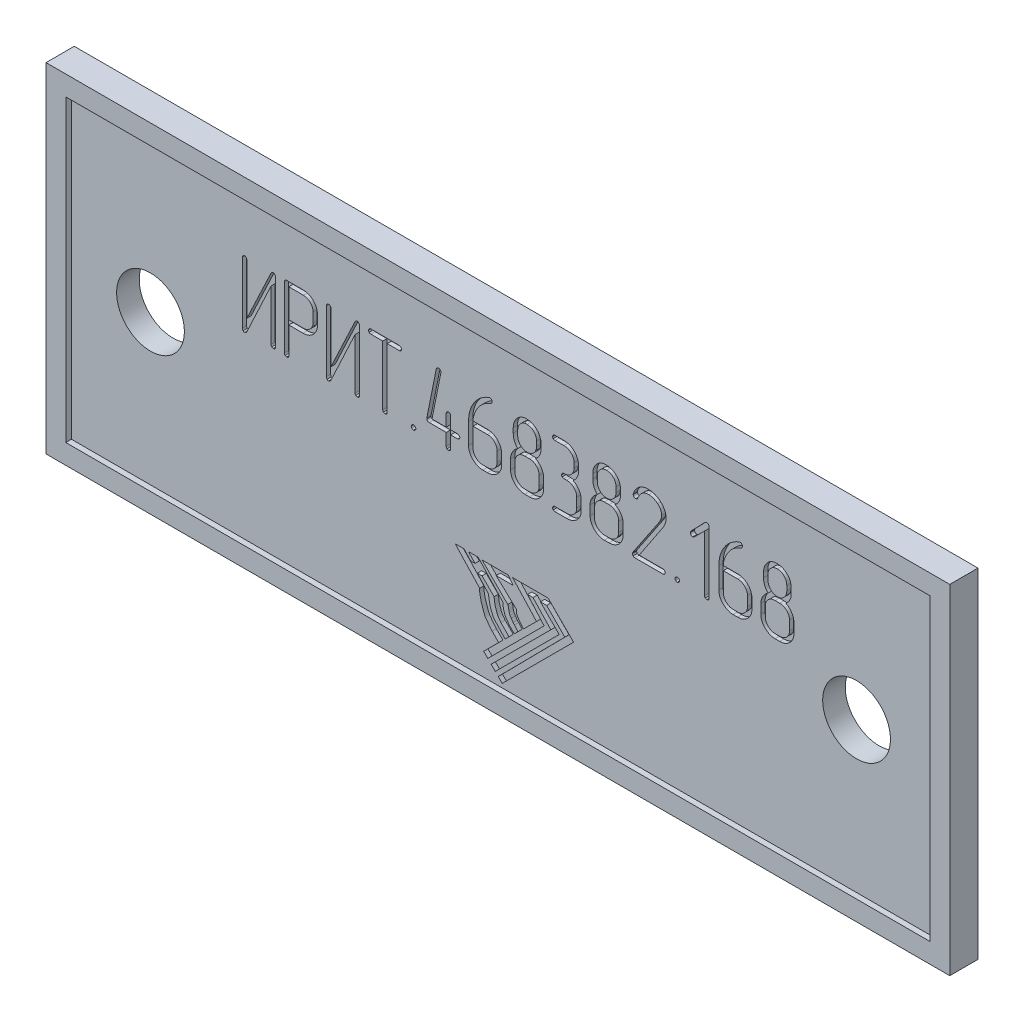
from build123d import *

# Parameters (mm, degrees)
SKETCH_1_W          = 32
SKETCH_1_H          = 12
EXTRUDE_1_DEPTH     = 0.5
SKETCH_2_W          = 30.6
SKETCH_2_H          = 10.6
CUT_EXTRUDE_1_DEPTH = 0.2
SKETCH_3_R          = 1.2
CUT_EXTRUDE_2_DEPTH = 4.2
CUT_EXTRUDE_3_DEPTH = 0.15
CUT_EXTRUDE_4_DEPTH = 0.15


with BuildPart() as part:
    # Эскиз1 → Бобышка-Вытянуть1 (new, symmetric)
    with BuildSketch(Plane.XY):
        Rectangle(SKETCH_1_W, SKETCH_1_H)
    extrude(amount=EXTRUDE_1_DEPTH, both=True)

    # Эскиз2 → Вырез-Вытянуть1 (cut)
    with BuildSketch(Plane.XY.offset(0.5)):
        Rectangle(SKETCH_2_W, SKETCH_2_H)
    extrude(amount=-CUT_EXTRUDE_1_DEPTH, mode=Mode.SUBTRACT)

    # Эскиз3 → Вырез-Вытянуть2 (cut)
    with BuildSketch(Plane.XY.offset(0.3)):
        with Locations((-12.5, 0)):
            Circle(SKETCH_3_R)
        with Locations((12.5, 0)):
            Circle(SKETCH_3_R)
    extrude(amount=-CUT_EXTRUDE_2_DEPTH, mode=Mode.SUBTRACT)

    # Эскиз5 → Вырез-Вытянуть3 (cut)
    with BuildSketch(Plane.XY.offset(0.3)):
        with BuildLine():
            Line((-0.703275484, -4.502257627), (-0.557091925, -4.648441186))
            Line((-0.557091925, -4.648441186), (1.437418015, -2.653931245))
            Line((1.437418015, -2.653931245), (0.851785105, -1.981851264))
            Line((0.851785105, -1.981851264), (1.042437507, -1.981851264))
            Line((1.042437507, -1.981851264), (1.67584886, -2.653931245))
            Line((1.67584886, -2.653931245), (-0.437876503, -4.767656608))
            Line((-0.437876503, -4.767656608), (-0.291195694, -4.914337417))
            Line((-0.291195694, -4.914337417), (1.969210478, -2.653931245))
            Line((1.969210478, -2.653931245), (1.306498163, -1.981851264))
            Line((1.306498163, -1.981851264), (1.527800952, -1.981851264))
            Line((1.527800952, -1.981851264), (2.170147202, -2.6332773))
            Line((2.170147202, -2.6332773), (-0.187210316, -5.018322796))
            Line((-0.187210316, -5.018322796), (-0.045903752, -5.15962936))
            Line((-0.045903752, -5.15962936), (2.480448308, -2.6332773))
            Line((2.480448308, -2.6332773), (1.577995014, -1.730824005))
            Line((1.577995014, -1.730824005), (0.321283549, -1.730824005))
            Line((0.321283549, -1.730824005), (1.167587984, -2.653931245))
            Line((1.167587984, -2.653931245), (0.704054689, -3.11746454))
            Line((0.704054689, -3.11746454), (0.536638855, -2.899784553))
            add(Edge.make_bspline(
                [(0.536638855, -2.899784553), (0.513416792, -2.861405476), (0.472968297, -2.800915497), (0.454045643, -2.730011098), (0.455350737, -2.702762209)],
                knots=[0, 0, 0, 0, 0.624963442, 1, 1, 1, 1], degree=3))
            Line((0.455350737, -2.702762209), (0.455350737, -2.6332773))
            Line((0.455350737, -2.6332773), (-0.262088902, -1.960905846))
            Line((-0.262088902, -1.960905846), (0.342309227, -1.960905846))
            Line((0.342309227, -1.960905846), (0.290276535, -1.893852102))
            Line((0.290276535, -1.893852102), (0.166592729, -1.730824005))
            Line((0.166592729, -1.730824005), (-0.760961719, -1.730824005))
            Line((-0.760961719, -1.730824005), (0.148843603, -2.640629327))
            add(Edge.make_bspline(
                [(0.148843603, -2.640629327), (0.16285718, -2.669983829), (0.180747755, -2.724836238), (0.185422748, -2.803698758), (0.203581656, -2.871303066), (0.213881106, -2.916428289), (0.230715168, -2.934961246)],
                knots=[0, 0, 0, 0, 0.31708811, 0.555738493, 0.765081765, 1, 1, 1, 1], degree=3))
            Line((0.230715168, -2.934961246), (0.27539568, -3.006527707))
            Line((0.27539568, -3.006527707), (0.342309227, -3.1060493))
            Line((0.342309227, -3.1060493), (0.384245939, -3.151011669))
            Line((0.384245939, -3.151011669), (0.508607928, -3.298907478))
            Line((0.508607928, -3.298907478), (0.384245939, -3.424094537))
            add(Edge.make_bspline(
                [(0.384245939, -3.424094537), (0.331111431, -3.377208329), (0.256788806, -3.311240089), (0.177166098, -3.211583155), (0.127781168, -3.138086299), (0.063755587, -3.052543064), (0.006434747, -2.887320078), (-0.029885414, -2.75280455), (-0.021183851, -2.653931245)],
                knots=[0, 0, 0, 0, 0.236603431, 0.329098738, 0.423989966, 0.53188256, 0.682852962, 1, 1, 1, 1], degree=3))
            Line((-0.021183851, -2.653931245), (-0.760961719, -1.866061771))
            Line((-0.760961719, -1.866061771), (-0.90065059, -1.71619689))
            Line((-0.90065059, -1.71619689), (-1.241625181, -1.71619689))
            Line((-1.241625181, -1.71619689), (-1.008331119, -1.960905846))
            Line((-1.008331119, -1.960905846), (-1.16627402, -1.960905846))
            Line((-1.16627402, -1.960905846), (-1.241625181, -1.880656244))
            Line((-1.241625181, -1.880656244), (-1.400980697, -1.709692047))
            Line((-1.400980697, -1.709692047), (-1.711073607, -1.709692047))
            Line((-1.711073607, -1.709692047), (-0.84296073, -2.640629327))
            add(Edge.make_bspline(
                [(-0.403073712, -3.737132865), (-0.479687041, -3.652576666), (-0.561918172, -3.534193877), (-0.67391007, -3.384158719), (-0.697799471, -3.280707622), (-0.73970454, -3.191513423), (-0.758148337, -3.102322812), (-0.79648849, -3.026515025), (-0.807699863, -2.939279023), (-0.840393023, -2.815382253), (-0.850573484, -2.71216971), (-0.84296073, -2.640629327)],
                knots=[0, 0, 0, 0, 0.278751235, 0.363225934, 0.457923128, 0.537758895, 0.606670127, 0.682233465, 0.745611303, 0.822853382, 1, 1, 1, 1], degree=3))
            Line((-0.403073712, -3.737132865), (-0.170612217, -3.96959436))
            Line((-0.170612217, -3.96959436), (-0.703275484, -4.502257627))
        make_face()
        with BuildLine():
            Line((-0.925058736, -2.21758448), (-0.760961719, -2.21758448))
            Line((-0.760961719, -2.21758448), (-0.334888541, -2.643657659))
            add(Edge.make_bspline(
                [(-0.092306173, -3.318898775), (-0.127654954, -3.277126203), (-0.1707999, -3.212276822), (-0.223789265, -3.128901249), (-0.244129814, -3.056985848), (-0.27001501, -2.986810431), (-0.292527154, -2.903839938), (-0.316305491, -2.82761872), (-0.313992086, -2.741342781), (-0.33828007, -2.66720039), (-0.334888541, -2.643657659)],
                knots=[0, 0, 0, 0, 0.192179536, 0.276772995, 0.345923046, 0.454704858, 0.540607626, 0.651164204, 0.72892584, 0.859285826, 0.859285826, 0.859285826, 0.859285826], degree=3))
            Line((-0.092306173, -3.318898775), (0.19471288, -3.609439535))
            Line((0.19471288, -3.609439535), (0.055550948, -3.746914656))
            Line((0.055550948, -3.746914656), (-0.361249861, -3.293118))
            Line((-0.361249861, -3.293118), (-0.403073712, -3.186172352))
            add(Edge.make_bspline(
                [(-0.54792513, -2.640629327), (-0.534467969, -2.651947928), (-0.536130258, -2.684381386), (-0.522964674, -2.724446247), (-0.520730117, -2.772798729), (-0.510403385, -2.83380978), (-0.495111711, -2.900714089), (-0.484028042, -2.965662199), (-0.470744703, -3.015711429), (-0.448753533, -3.0912786), (-0.420526654, -3.144516319), (-0.403073712, -3.186172352)],
                knots=[0, 0, 0, 0, 0.084251317, 0.160376051, 0.222667406, 0.338088596, 0.486925579, 0.58484895, 0.685662598, 0.76009385, 1, 1, 1, 1], degree=3))
            Line((-0.54792513, -2.640629327), (-0.925058736, -2.21758448))
        make_face(mode=Mode.SUBTRACT)
    extrude(amount=-CUT_EXTRUDE_3_DEPTH, mode=Mode.SUBTRACT)

    # Эскиз6 → Вырез-Вытянуть4 (cut)
    # profile 1 of 15: a face of its own
    with BuildSketch(Plane.XY.offset(0.3)):
        with BuildLine():
            add(Edge.make_bspline(
                [(-8.075108283, 1.13953231), (-8.075729701, 1.127224547), (-8.076902791, 1.103990397), (-8.090818621, 1.085445921), (-8.097362856, 1.076724961)],
                knots=[0, 0, 0, 0, 1.059454627, 2, 2, 2, 2], degree=3))
            add(Edge.make_bspline(
                [(-8.097362856, 1.076724961), (-8.105476607, 1.070958484), (-8.122473026, 1.058879061), (-8.143333535, 1.057607606), (-8.154235652, 1.056943118)],
                knots=[0, 0, 0, 0, 0.954760139, 2, 2, 2, 2], degree=3))
            add(Edge.make_bspline(
                [(-8.154235652, 1.056943118), (-8.1572162, 1.057372796), (-8.164280074, 1.058391129), (-8.176583205, 1.062188775), (-8.191931098, 1.068723344), (-8.203371952, 1.073897234), (-8.209624811, 1.076724961)],
                knots=[0, 0, 0, 0, 0.611243656, 1.448642307, 2.605586658, 4, 4, 4, 4], degree=3))
            add(Edge.make_bspline(
                [(-8.209624811, 1.076724961), (-8.213333989, 1.080332858), (-8.221037718, 1.087826236), (-8.228055988, 1.103209821), (-8.232702619, 1.12095384), (-8.233133642, 1.133724938), (-8.233363022, 1.140521402)],
                knots=[0, 0, 0, 0, 0.877726456, 1.822982762, 2.841444951, 4, 4, 4, 4], degree=3))
            Line((-8.233363022, 1.140521402), (-8.233363022, 2.931272679))
            Line((-8.233363022, 2.931272679), (-9.085960426, 1.105408632))
            add(Edge.make_bspline(
                [(-9.085960426, 1.105408632), (-9.091111297, 1.095535462), (-9.100597497, 1.077352349), (-9.120468313, 1.056208914), (-9.14327106, 1.042173307), (-9.160121788, 1.04081027), (-9.168549618, 1.040128552)],
                knots=[0, 0, 0, 0, 1.194901128, 2.200612631, 3.10004299, 4, 4, 4, 4], degree=3))
            add(Edge.make_bspline(
                [(-9.168549618, 1.040128552), (-9.178653444, 1.041414294), (-9.19980016, 1.044105276), (-9.215982729, 1.058062099), (-9.224433322, 1.065350401)],
                knots=[0, 0, 0, 0, 0.955593002, 2, 2, 2, 2], degree=3))
            add(Edge.make_bspline(
                [(-9.224433322, 1.065350401), (-9.23077437, 1.075446811), (-9.244227034, 1.096866557), (-9.245513351, 1.122189316), (-9.246193349, 1.135575941)],
                knots=[0, 0, 0, 0, 0.942719858, 2, 2, 2, 2], degree=3))
            Line((-9.246193349, 1.135575941), (-9.246193349, 3.310094959))
            add(Edge.make_bspline(
                [(-9.246193349, 3.310094959), (-9.244866726, 3.319389212), (-9.241971234, 3.339674871), (-9.226251488, 3.361609577), (-9.210688294, 3.377375594), (-9.197494169, 3.387345154), (-9.182383865, 3.392291634), (-9.17220379, 3.393209834), (-9.16706598, 3.393673243)],
                knots=[0, 0, 0, 0, 1.334134237, 2.911884587, 3.749786952, 4.532228059, 5.259226067, 6, 6, 6, 6], degree=3))
            add(Edge.make_bspline(
                [(-9.16706598, 3.393673243), (-9.157620334, 3.39253841), (-9.137841279, 3.390162085), (-9.116257571, 3.375781509), (-9.101643385, 3.360409963), (-9.093697287, 3.345561557), (-9.088569098, 3.328564356), (-9.088153813, 3.316399065), (-9.08793861, 3.310094959)],
                knots=[0, 0, 0, 0, 1.32341113, 2.771205292, 3.526191183, 4.294240695, 5.116068297, 6, 6, 6, 6], degree=3))
            Line((-9.08793861, 3.310094959), (-9.08793861, 1.514892768))
            Line((-9.08793861, 1.514892768), (-8.235341206, 3.322953157))
            add(Edge.make_bspline(
                [(-8.235341206, 3.322953157), (-8.230179517, 3.332029474), (-8.220611069, 3.348854637), (-8.200460902, 3.367850024), (-8.177836705, 3.380701581), (-8.161160145, 3.381763351), (-8.152752014, 3.382298684)],
                knots=[0, 0, 0, 0, 1.161436353, 2.153004897, 3.068766186, 4, 4, 4, 4], degree=3))
            add(Edge.make_bspline(
                [(-8.152752014, 3.382298684), (-8.143863345, 3.380881458), (-8.123993377, 3.377713354), (-8.104294823, 3.359415758), (-8.089410501, 3.342159693), (-8.080861287, 3.325985503), (-8.075760151, 3.307767107), (-8.075330653, 3.294963769), (-8.075108283, 3.288334933)],
                knots=[0, 0, 0, 0, 1.192153419, 2.664971594, 3.470900437, 4.27682928, 5.107840801, 6, 6, 6, 6], degree=3))
            Line((-8.075108283, 3.288334933), (-8.075108283, 1.13953231))
        make_face()
    # profile 2 of 15: a face of its own
    with BuildSketch(Plane.XY.offset(0.3)):
        with BuildLine():
            Line((-7.600344067, 2.052958879), (-7.600344067, 1.117277737))
            add(Edge.make_bspline(
                [(-7.600344067, 1.117277737), (-7.600963931, 1.104653128), (-7.602133705, 1.080828642), (-7.616054488, 1.061553457), (-7.62259864, 1.052492204)],
                knots=[0, 0, 0, 0, 1.05980118, 2, 2, 2, 2], degree=3))
            add(Edge.make_bspline(
                [(-7.62259864, 1.052492204), (-7.630691023, 1.046520779), (-7.647566495, 1.034068253), (-7.668550172, 1.032849916), (-7.679471437, 1.032215815)],
                knots=[0, 0, 0, 0, 0.959070502, 2, 2, 2, 2], degree=3))
            add(Edge.make_bspline(
                [(-7.679471437, 1.032215815), (-7.682452296, 1.032644818), (-7.689516906, 1.03366155), (-7.701811936, 1.037476787), (-7.717271344, 1.043934009), (-7.728626469, 1.049458938), (-7.734860595, 1.052492204)],
                knots=[0, 0, 0, 0, 0.609110167, 1.443585955, 2.596492098, 4, 4, 4, 4], degree=3))
            add(Edge.make_bspline(
                [(-7.734860595, 1.052492204), (-7.738550983, 1.056108495), (-7.746110069, 1.063515808), (-7.753515765, 1.078720296), (-7.757849046, 1.09658786), (-7.758340505, 1.109501494), (-7.758598806, 1.116288645)],
                knots=[0, 0, 0, 0, 0.877244586, 1.796875224, 2.842080996, 4, 4, 4, 4], degree=3))
            Line((-7.758598806, 1.116288645), (-7.758598806, 3.298225854))
            add(Edge.make_bspline(
                [(-7.758598806, 3.298225854), (-7.757720421, 3.310592146), (-7.756110971, 3.333250673), (-7.74014613, 3.363615908), (-7.709945127, 3.379923084), (-7.687401989, 3.381456486), (-7.675020522, 3.382298684)],
                knots=[0, 0, 0, 0, 1.094991096, 2.00633194, 2.905008904, 4, 4, 4, 4], degree=3))
            Line((-7.675020522, 3.382298684), (-7.090467081, 3.382298684))
            add(Edge.make_bspline(
                [(-7.090467081, 3.382298684), (-7.073634784, 3.381744921), (-7.040344768, 3.380649717), (-6.991252802, 3.374314529), (-6.943939295, 3.362997293), (-6.89881734, 3.346212595), (-6.854922994, 3.32621402), (-6.813340918, 3.300673864), (-6.773542089, 3.270751671), (-6.735967505, 3.2368593), (-6.700807041, 3.200293183), (-6.670696892, 3.160646148), (-6.645328867, 3.119083185), (-6.623638797, 3.075975254), (-6.607456996, 3.030414759), (-6.596115249, 2.982983796), (-6.588980607, 2.933795829), (-6.588007703, 2.900305465), (-6.58751374, 2.883301711)],
                knots=[0, 0, 0, 0, 1.026231841, 2.029626376, 3.011864463, 3.98459813, 4.960182494, 5.947701056, 6.952604077, 7.991597993, 9.029424937, 10.040389341, 11.019332009, 11.99455402, 12.976740702, 13.958978789, 14.963731063, 16, 16, 16, 16], degree=3))
            Line((-6.58751374, 2.883301711), (-6.58751374, 2.550472214))
            add(Edge.make_bspline(
                [(-6.58751374, 2.550472214), (-6.588004724, 2.533631879), (-6.588971654, 2.50046695), (-6.596147232, 2.451787937), (-6.607304409, 2.404937343), (-6.62399435, 2.360166567), (-6.644787634, 2.316816626), (-6.670461376, 2.275345704), (-6.701137334, 2.236067954), (-6.735275283, 2.198721997), (-6.773154818, 2.164912774), (-6.813319514, 2.13500023), (-6.855481754, 2.10984113), (-6.899311133, 2.088560406), (-6.945576325, 2.072926065), (-6.993597663, 2.061595518), (-7.043600363, 2.05439855), (-7.077584357, 2.053445159), (-7.094917996, 2.052958879)],
                knots=[0, 0, 0, 0, 1.022983715, 2.014638301, 2.984034422, 3.944278223, 4.912016724, 5.901645456, 6.901462775, 7.936489751, 8.972195148, 9.981949218, 10.974918392, 11.951687629, 12.936895745, 13.93550798, 14.946999625, 16, 16, 16, 16], degree=3))
            Line((-7.094917996, 2.052958879), (-7.600344067, 2.052958879))
        make_face()
        with BuildLine():
            Line((-7.600344067, 2.211213618), (-7.088488897, 2.211213618))
            add(Edge.make_bspline(
                [(-7.088488897, 2.211213618), (-7.066096855, 2.212256284), (-7.022008669, 2.214309211), (-6.958510081, 2.233636977), (-6.899617302, 2.264311456), (-6.846914506, 2.306297371), (-6.801401249, 2.356359974), (-6.769570809, 2.415178341), (-6.749107723, 2.479401751), (-6.746899802, 2.524431832), (-6.745768479, 2.547504938)],
                knots=[0, 0, 0, 0, 1.00522593, 1.979211506, 2.957845532, 3.977200418, 4.996582287, 5.979199191, 6.964555453, 8, 8, 8, 8], degree=3))
            Line((-6.745768479, 2.547504938), (-6.745768479, 2.885774441))
            add(Edge.make_bspline(
                [(-6.745768479, 2.885774441), (-6.746962719, 2.908336633), (-6.749299, 2.952474845), (-6.769086442, 3.016040498), (-6.801248729, 3.074223087), (-6.845407246, 3.125654068), (-6.89769181, 3.16886187), (-6.956273557, 3.201526391), (-7.020928139, 3.220327113), (-7.065620478, 3.222785847), (-7.088488897, 3.224043945)],
                knots=[0, 0, 0, 0, 1.011824223, 1.979422563, 2.960615425, 3.980027661, 5.006063443, 5.993747424, 6.973429768, 8, 8, 8, 8], degree=3))
            Line((-7.088488897, 3.224043945), (-7.600344067, 3.224043945))
            Line((-7.600344067, 3.224043945), (-7.600344067, 2.211213618))
        make_face(mode=Mode.SUBTRACT)
    # profile 3 of 15: a face of its own
    with BuildSketch(Plane.XY.offset(0.3)):
        with BuildLine():
            add(Edge.make_bspline(
                [(-5.099919197, 1.13953231), (-5.100540615, 1.127224547), (-5.101713705, 1.103990397), (-5.115629535, 1.085445921), (-5.12217377, 1.076724961)],
                knots=[0, 0, 0, 0, 1.059454627, 2, 2, 2, 2], degree=3))
            add(Edge.make_bspline(
                [(-5.12217377, 1.076724961), (-5.130287521, 1.070958484), (-5.14728394, 1.058879061), (-5.168144449, 1.057607606), (-5.179046566, 1.056943118)],
                knots=[0, 0, 0, 0, 0.954760139, 2, 2, 2, 2], degree=3))
            add(Edge.make_bspline(
                [(-5.179046566, 1.056943118), (-5.182027114, 1.057372796), (-5.189090988, 1.058391129), (-5.201394119, 1.062188775), (-5.216742012, 1.068723344), (-5.228182866, 1.073897234), (-5.234435725, 1.076724961)],
                knots=[0, 0, 0, 0, 0.611243656, 1.448642307, 2.605586658, 4, 4, 4, 4], degree=3))
            add(Edge.make_bspline(
                [(-5.234435725, 1.076724961), (-5.238144903, 1.080332858), (-5.245848632, 1.087826236), (-5.252866902, 1.103209821), (-5.257513533, 1.12095384), (-5.257944556, 1.133724938), (-5.258173936, 1.140521402)],
                knots=[0, 0, 0, 0, 0.877726456, 1.822982762, 2.841444951, 4, 4, 4, 4], degree=3))
            Line((-5.258173936, 1.140521402), (-5.258173936, 2.931272679))
            Line((-5.258173936, 2.931272679), (-6.11077134, 1.105408632))
            add(Edge.make_bspline(
                [(-6.11077134, 1.105408632), (-6.115922211, 1.095535462), (-6.125408411, 1.077352349), (-6.145279227, 1.056208914), (-6.168081974, 1.042173307), (-6.184932702, 1.04081027), (-6.193360532, 1.040128552)],
                knots=[0, 0, 0, 0, 1.194901128, 2.200612631, 3.10004299, 4, 4, 4, 4], degree=3))
            add(Edge.make_bspline(
                [(-6.193360532, 1.040128552), (-6.203464358, 1.041414294), (-6.224611074, 1.044105276), (-6.240793642, 1.058062099), (-6.249244236, 1.065350401)],
                knots=[0, 0, 0, 0, 0.955593002, 2, 2, 2, 2], degree=3))
            add(Edge.make_bspline(
                [(-6.249244236, 1.065350401), (-6.255585283, 1.075446811), (-6.269037948, 1.096866557), (-6.270324265, 1.122189316), (-6.271004263, 1.135575941)],
                knots=[0, 0, 0, 0, 0.942719858, 2, 2, 2, 2], degree=3))
            Line((-6.271004263, 1.135575941), (-6.271004263, 3.310094959))
            add(Edge.make_bspline(
                [(-6.271004263, 3.310094959), (-6.269677639, 3.319389212), (-6.266782148, 3.339674871), (-6.251062402, 3.361609577), (-6.235499208, 3.377375594), (-6.222305083, 3.387345154), (-6.207194779, 3.392291634), (-6.197014704, 3.393209834), (-6.191876894, 3.393673243)],
                knots=[0, 0, 0, 0, 1.334134237, 2.911884587, 3.749786952, 4.532228059, 5.259226067, 6, 6, 6, 6], degree=3))
            add(Edge.make_bspline(
                [(-6.191876894, 3.393673243), (-6.182431248, 3.39253841), (-6.162652192, 3.390162085), (-6.141068485, 3.375781509), (-6.126454299, 3.360409963), (-6.118508201, 3.345561557), (-6.113380012, 3.328564356), (-6.112964727, 3.316399065), (-6.112749524, 3.310094959)],
                knots=[0, 0, 0, 0, 1.32341113, 2.771205292, 3.526191183, 4.294240695, 5.116068297, 6, 6, 6, 6], degree=3))
            Line((-6.112749524, 3.310094959), (-6.112749524, 1.514892768))
            Line((-6.112749524, 1.514892768), (-5.26015212, 3.322953157))
            add(Edge.make_bspline(
                [(-5.26015212, 3.322953157), (-5.25499043, 3.332029474), (-5.245421983, 3.348854637), (-5.225271815, 3.367850024), (-5.202647619, 3.380701581), (-5.185971059, 3.381763351), (-5.177562928, 3.382298684)],
                knots=[0, 0, 0, 0, 1.161436353, 2.153004897, 3.068766186, 4, 4, 4, 4], degree=3))
            add(Edge.make_bspline(
                [(-5.177562928, 3.382298684), (-5.168674259, 3.380881458), (-5.148804291, 3.377713354), (-5.129105737, 3.359415758), (-5.114221415, 3.342159693), (-5.105672201, 3.325985503), (-5.100571064, 3.307767107), (-5.100141566, 3.294963769), (-5.099919197, 3.288334933)],
                knots=[0, 0, 0, 0, 1.192153419, 2.664971594, 3.470900437, 4.27682928, 5.107840801, 6, 6, 6, 6], degree=3))
            Line((-5.099919197, 3.288334933), (-5.099919197, 1.13953231))
        make_face()
    # profile 4 of 15: a face of its own
    with BuildSketch(Plane.XY.offset(0.3)):
        with BuildLine():
            Line((-4.276994556, 3.224043945), (-4.698842344, 3.224043945))
            add(Edge.make_bspline(
                [(-4.698842344, 3.224043945), (-4.710959878, 3.224723981), (-4.734126721, 3.226024104), (-4.752761791, 3.239751368), (-4.761649693, 3.246298518)],
                knots=[0, 0, 0, 0, 1.046110099, 2, 2, 2, 2], degree=3))
            add(Edge.make_bspline(
                [(-4.761649693, 3.246298518), (-4.76799617, 3.254855543), (-4.780558634, 3.271793652), (-4.782465962, 3.292784774), (-4.78340972, 3.303171315)],
                knots=[0, 0, 0, 0, 1.010387255, 2, 2, 2, 2], degree=3))
            add(Edge.make_bspline(
                [(-4.78340972, 3.303171315), (-4.781918693, 3.310215493), (-4.778259472, 3.327503051), (-4.765494419, 3.347842289), (-4.751754518, 3.365510502), (-4.736477395, 3.37503749), (-4.719121315, 3.381406774), (-4.706490203, 3.381990801), (-4.699831436, 3.382298684)],
                knots=[0, 0, 0, 0, 1.024159565, 2.513454098, 3.383378277, 4.201210432, 5.051728657, 6, 6, 6, 6], degree=3))
            Line((-4.699831436, 3.382298684), (-3.695902938, 3.382298684))
            add(Edge.make_bspline(
                [(-3.695902938, 3.382298684), (-3.685875974, 3.380908687), (-3.664617043, 3.377961649), (-3.638417371, 3.358005583), (-3.616580634, 3.333486571), (-3.613669114, 3.312747877), (-3.612324654, 3.303171315)],
                knots=[0, 0, 0, 0, 0.956741333, 2.028460119, 3.089596672, 4, 4, 4, 4], degree=3))
            add(Edge.make_bspline(
                [(-3.612324654, 3.303171315), (-3.613459489, 3.293725674), (-3.61583582, 3.273946627), (-3.630216361, 3.252362858), (-3.645587983, 3.237748808), (-3.660436146, 3.229802268), (-3.677593206, 3.224627994), (-3.689926735, 3.224244923), (-3.696397484, 3.224043945)],
                knots=[0, 0, 0, 0, 1.318331355, 2.760568309, 3.512656267, 4.2777577, 5.096430803, 6, 6, 6, 6], degree=3))
            Line((-3.696397484, 3.224043945), (-4.118739818, 3.224043945))
            Line((-4.118739818, 3.224043945), (-4.118739818, 1.116288645))
            add(Edge.make_bspline(
                [(-4.118739818, 1.116288645), (-4.119360383, 1.103822527), (-4.120531653, 1.080293666), (-4.134450201, 1.061383391), (-4.14099439, 1.052492204)],
                knots=[0, 0, 0, 0, 1.059644816, 2, 2, 2, 2], degree=3))
            add(Edge.make_bspline(
                [(-4.14099439, 1.052492204), (-4.149086774, 1.046520779), (-4.165962245, 1.034068253), (-4.186945923, 1.032849916), (-4.197867187, 1.032215815)],
                knots=[0, 0, 0, 0, 0.959070502, 2, 2, 2, 2], degree=3))
            add(Edge.make_bspline(
                [(-4.197867187, 1.032215815), (-4.200848046, 1.032644818), (-4.207912657, 1.03366155), (-4.220207686, 1.037476787), (-4.235667094, 1.043934009), (-4.247022219, 1.049458938), (-4.253256345, 1.052492204)],
                knots=[0, 0, 0, 0, 0.609110167, 1.443585955, 2.596492098, 4, 4, 4, 4], degree=3))
            add(Edge.make_bspline(
                [(-4.253256345, 1.052492204), (-4.256965523, 1.056100101), (-4.264669252, 1.063593479), (-4.271687522, 1.078977064), (-4.276334153, 1.096721083), (-4.276765176, 1.109492181), (-4.276994556, 1.116288645)],
                knots=[0, 0, 0, 0, 0.877726456, 1.822982762, 2.841444951, 4, 4, 4, 4], degree=3))
            Line((-4.276994556, 1.116288645), (-4.276994556, 3.224043945))
        make_face()
    # profile 5 of 15: a face of its own
    with BuildSketch(Plane.XY.offset(0.3)):
        with BuildLine():
            add(Edge.make_bspline(
                [(-3.185531406, 1.198383291), (-3.175504441, 1.196993294), (-3.154245511, 1.194046256), (-3.128045839, 1.17409019), (-3.106209102, 1.149571178), (-3.103297582, 1.128832484), (-3.101953122, 1.119255922)],
                knots=[0, 0, 0, 0, 0.956741333, 2.028460119, 3.089596672, 4, 4, 4, 4], degree=3))
            add(Edge.make_bspline(
                [(-3.101953122, 1.119255922), (-3.103087955, 1.109810276), (-3.10546428, 1.09003122), (-3.119844856, 1.068447513), (-3.135216403, 1.053833327), (-3.150064808, 1.045887229), (-3.167062009, 1.04075904), (-3.1792273, 1.040343755), (-3.185531406, 1.040128552)],
                knots=[0, 0, 0, 0, 1.32341113, 2.771205292, 3.526191183, 4.294240695, 5.116068297, 6, 6, 6, 6], degree=3))
            add(Edge.make_bspline(
                [(-3.185531406, 1.040128552), (-3.191701332, 1.04044192), (-3.203537257, 1.041043062), (-3.220178979, 1.047697209), (-3.235361912, 1.05735516), (-3.242972988, 1.066907304), (-3.246855117, 1.0717795)],
                knots=[0, 0, 0, 0, 1.026751877, 1.969644071, 2.964390286, 4, 4, 4, 4], degree=3))
            add(Edge.make_bspline(
                [(-3.246855117, 1.0717795), (-3.25319997, 1.079821033), (-3.265505797, 1.095417568), (-3.267600476, 1.115141571), (-3.268615144, 1.124695928)],
                knots=[0, 0, 0, 0, 1.031194858, 2, 2, 2, 2], degree=3))
            add(Edge.make_bspline(
                [(-3.268615144, 1.124695928), (-3.26708525, 1.131225894), (-3.263269696, 1.147511625), (-3.25104297, 1.166854379), (-3.236419351, 1.182516877), (-3.221925713, 1.192419653), (-3.204258677, 1.197095555), (-3.19198024, 1.197939852), (-3.185531406, 1.198383291)],
                knots=[0, 0, 0, 0, 0.992240781, 2.474647878, 3.32324587, 4.172197077, 5.040008407, 6, 6, 6, 6], degree=3))
        make_face()
    # profile 6 of 15: a face of its own
    with BuildSketch(Plane.XY.offset(0.3)):
        with BuildLine():
            Line((-1.871522529, 1.704798454), (-1.628205869, 1.704798454))
            add(Edge.make_bspline(
                [(-1.628205869, 1.704798454), (-1.618509823, 1.703394881), (-1.597862827, 1.700406076), (-1.572533827, 1.68046152), (-1.551958339, 1.655689921), (-1.548982466, 1.635217203), (-1.547594861, 1.625671085)],
                knots=[0, 0, 0, 0, 0.943777376, 2.009702695, 3.071954509, 4, 4, 4, 4], degree=3))
            add(Edge.make_bspline(
                [(-1.547594861, 1.625671085), (-1.548752362, 1.61623476), (-1.55116555, 1.596561654), (-1.565063648, 1.575010795), (-1.579830261, 1.560253687), (-1.594073025, 1.552417658), (-1.610360701, 1.547102191), (-1.622059033, 1.546736085), (-1.628205869, 1.546543716)],
                knots=[0, 0, 0, 0, 1.349677805, 2.813844879, 3.56655187, 4.329224035, 5.12209841, 6, 6, 6, 6], degree=3))
            Line((-1.628205869, 1.546543716), (-1.871522529, 1.546543716))
            Line((-1.871522529, 1.546543716), (-1.871522529, 1.117772283))
            add(Edge.make_bspline(
                [(-1.871522529, 1.117772283), (-1.872142393, 1.105147674), (-1.873312167, 1.081323188), (-1.88723295, 1.062048003), (-1.893777102, 1.05298675)],
                knots=[0, 0, 0, 0, 1.05980118, 2, 2, 2, 2], degree=3))
            add(Edge.make_bspline(
                [(-1.893777102, 1.05298675), (-1.901875697, 1.047051816), (-1.918786091, 1.034659288), (-1.939734132, 1.03305289), (-1.950649898, 1.032215815)],
                knots=[0, 0, 0, 0, 0.957824586, 2, 2, 2, 2], degree=3))
            add(Edge.make_bspline(
                [(-1.950649898, 1.032215815), (-1.953640008, 1.032615333), (-1.960775407, 1.033568716), (-1.972870936, 1.038189404), (-1.988475945, 1.04434492), (-1.999814195, 1.049923842), (-2.006039057, 1.05298675)],
                knots=[0, 0, 0, 0, 0.607598108, 1.449932014, 2.599976176, 4, 4, 4, 4], degree=3))
            add(Edge.make_bspline(
                [(-2.006039057, 1.05298675), (-2.009715713, 1.056781207), (-2.017156555, 1.064460455), (-2.024718096, 1.079688298), (-2.029059387, 1.097744476), (-2.029528114, 1.110821267), (-2.029777268, 1.117772283)],
                knots=[0, 0, 0, 0, 0.887354912, 1.795835147, 2.828367935, 4, 4, 4, 4], degree=3))
            Line((-2.029777268, 1.117772283), (-2.029777268, 1.546543716))
            Line((-2.029777268, 1.546543716), (-2.634112551, 1.546543716))
            add(Edge.make_bspline(
                [(-2.634112551, 1.546543716), (-2.645441331, 1.547418633), (-2.66741734, 1.549115833), (-2.694886458, 1.56710226), (-2.713714117, 1.592522175), (-2.716040841, 1.612688996), (-2.717196289, 1.622703809)],
                knots=[0, 0, 0, 0, 1.073682428, 2.082770952, 3.047906965, 4, 4, 4, 4], degree=3))
            Line((-2.717196289, 1.622703809), (-2.71571265, 1.642980197))
            Line((-2.71571265, 1.642980197), (-2.381894061, 3.315534966))
            add(Edge.make_bspline(
                [(-2.381894061, 3.315534966), (-2.379734685, 3.325822518), (-2.375602127, 3.345510562), (-2.360781413, 3.359029298), (-2.353704936, 3.365484118)],
                knots=[0, 0, 0, 0, 1.045055818, 2, 2, 2, 2], degree=3))
            Line((-2.353704936, 3.365484118), (-2.3017776, 3.382298684))
            add(Edge.make_bspline(
                [(-2.3017776, 3.382298684), (-2.291140121, 3.381326109), (-2.2695184, 3.379349254), (-2.246186066, 3.363711853), (-2.231262832, 3.347688596), (-2.222461617, 3.333524408), (-2.217415262, 3.317351801), (-2.216952473, 3.306008203), (-2.216715678, 3.300204038)],
                knots=[0, 0, 0, 0, 1.445961407, 2.939058641, 3.7071236, 4.447742701, 5.205758405, 6, 6, 6, 6], degree=3))
            Line((-2.216715678, 3.300204038), (-2.218199316, 3.281411288))
            Line((-2.218199316, 3.281411288), (-2.532236063, 1.704798454))
            Line((-2.532236063, 1.704798454), (-2.029777268, 1.704798454))
            Line((-2.029777268, 1.704798454), (-2.029777268, 2.127140788))
            add(Edge.make_bspline(
                [(-2.029777268, 2.127140788), (-2.028425203, 2.136419857), (-2.025453926, 2.156811385), (-2.009969706, 2.179074063), (-1.994265564, 2.194911904), (-1.981079672, 2.204886497), (-1.965967391, 2.209831769), (-1.955787577, 2.210750129), (-1.950649898, 2.211213618)],
                knots=[0, 0, 0, 0, 1.329704796, 2.922137395, 3.757257852, 4.537101187, 5.2616855, 6, 6, 6, 6], degree=3))
            add(Edge.make_bspline(
                [(-1.950649898, 2.211213618), (-1.941204257, 2.210078783), (-1.921425211, 2.207702452), (-1.899841442, 2.193321911), (-1.885227392, 2.177950289), (-1.877280852, 2.163102126), (-1.872106578, 2.145945066), (-1.871723507, 2.133611537), (-1.871522529, 2.127140788)],
                knots=[0, 0, 0, 0, 1.318331355, 2.760568309, 3.512656267, 4.2777577, 5.096430803, 6, 6, 6, 6], degree=3))
            Line((-1.871522529, 2.127140788), (-1.871522529, 1.704798454))
        make_face()
    # profile 7 of 15: a face of its own
    with BuildSketch(Plane.XY.offset(0.3)):
        with BuildLine():
            add(Edge.make_bspline(
                [(-1.238503575, 2.285395527), (-1.237904043, 2.314099514), (-1.236712763, 2.371134812), (-1.228065626, 2.455728861), (-1.214269896, 2.538506888), (-1.194996189, 2.619549195), (-1.169678696, 2.698661274), (-1.138886343, 2.775953885), (-1.10289018, 2.851688355), (-1.074359972, 2.899990633), (-1.059972448, 2.924349034)],
                knots=[0, 0, 0, 0, 1.025012318, 2.036716423, 3.03363194, 4.020360408, 5.009036524, 5.997344461, 6.990078998, 8, 8, 8, 8], degree=3))
            add(Edge.make_bspline(
                [(-1.059972448, 2.924349034), (-1.04322578, 2.949854358), (-1.010051581, 3.000378959), (-0.953705823, 3.070615934), (-0.893267688, 3.136004299), (-0.827415988, 3.195241286), (-0.756842621, 3.24884068), (-0.681802126, 3.296994392), (-0.602016788, 3.339915042), (-0.54585522, 3.363465856), (-0.517455422, 3.375375039)],
                knots=[0, 0, 0, 0, 1.019459944, 2.019492377, 3.005950325, 3.993085277, 4.976197539, 5.965191866, 6.97103761, 8, 8, 8, 8], degree=3))
            Line((-0.517455422, 3.375375039), (-0.482837198, 3.382298684))
            add(Edge.make_bspline(
                [(-0.482837198, 3.382298684), (-0.477328374, 3.382146895), (-0.466663168, 3.381853027), (-0.451852287, 3.375641998), (-0.438094634, 3.36732298), (-0.423010558, 3.351372727), (-0.406962811, 3.327931587), (-0.405119394, 3.305766268), (-0.404204374, 3.294764032)],
                knots=[0, 0, 0, 0, 0.756498154, 1.464597574, 2.193015444, 2.967892751, 4.494947797, 6, 6, 6, 6], degree=3))
            add(Edge.make_bspline(
                [(-0.404204374, 3.294764032), (-0.404767971, 3.287265157), (-0.40585973, 3.272738853), (-0.415007756, 3.251558444), (-0.433352708, 3.232729836), (-0.449408789, 3.222804657), (-0.458604441, 3.2171203)],
                knots=[0, 0, 0, 0, 0.897913931, 1.739376887, 2.7052941, 4, 4, 4, 4], degree=3))
            Line((-0.458604441, 3.2171203), (-0.490749935, 3.205251195))
            Line((-0.490749935, 3.205251195), (-0.528335435, 3.188436629))
            Line((-0.528335435, 3.188436629), (-0.599550067, 3.151345675))
            add(Edge.make_bspline(
                [(-0.599550067, 3.151345675), (-0.621292129, 3.137938534), (-0.665062972, 3.110947447), (-0.705043537, 3.078604692), (-0.725164766, 3.062327384)],
                knots=[0, 0, 0, 0, 0.993449501, 2, 2, 2, 2], degree=3))
            add(Edge.make_bspline(
                [(-0.725164766, 3.062327384), (-0.742589527, 3.047460413), (-0.778742773, 3.016614119), (-0.829490989, 2.962467527), (-0.880190264, 2.900705893), (-0.911304051, 2.855045631), (-0.927434104, 2.831374375)],
                knots=[0, 0, 0, 0, 0.891355676, 1.849402815, 2.885084417, 4, 4, 4, 4], degree=3))
            add(Edge.make_bspline(
                [(-0.927434104, 2.831374375), (-0.93750641, 2.81399931), (-0.957859662, 2.778889268), (-0.985520099, 2.723478582), (-1.011793798, 2.665386395), (-1.035229905, 2.60485213), (-1.054993182, 2.543859219), (-1.069487523, 2.484062445), (-1.078335067, 2.426110538), (-1.079618489, 2.388124867), (-1.080248836, 2.369468357)],
                knots=[0, 0, 0, 0, 0.979793692, 1.979883106, 3.020433534, 4.090023591, 5.145760834, 6.146658688, 7.089738827, 8, 8, 8, 8], degree=3))
            Line((-1.080248836, 2.369468357), (-0.575317311, 2.369468357))
            add(Edge.make_bspline(
                [(-0.575317311, 2.369468357), (-0.557825835, 2.368926189), (-0.523549129, 2.367863745), (-0.472979552, 2.361464341), (-0.424613757, 2.350094191), (-0.378257636, 2.334116002), (-0.333861294, 2.313842088), (-0.291993376, 2.288443942), (-0.251829965, 2.258926497), (-0.214418688, 2.225143767), (-0.179811694, 2.188508933), (-0.150119343, 2.148927026), (-0.123926268, 2.107922912), (-0.10331913, 2.064305691), (-0.087253176, 2.018719401), (-0.076081879, 1.971290573), (-0.068850373, 1.921794105), (-0.0679022, 1.888135957), (-0.067418509, 1.87096593)],
                knots=[0, 0, 0, 0, 1.058923538, 2.075091507, 3.079580412, 4.061004508, 5.038820135, 6.027975482, 7.019895312, 8.051622738, 9.075356851, 10.065266913, 11.042624177, 12.015641807, 12.978216217, 13.963286107, 14.96101137, 16, 16, 16, 16], degree=3))
            Line((-0.067418509, 1.87096593), (-0.067418509, 1.538630979))
            add(Edge.make_bspline(
                [(-0.067418509, 1.538630979), (-0.067986333, 1.52163914), (-0.069103969, 1.488194508), (-0.075180021, 1.438818529), (-0.087560876, 1.391820687), (-0.103181257, 1.346220862), (-0.124137776, 1.302990688), (-0.149035746, 1.261119607), (-0.179282216, 1.221987386), (-0.213348785, 1.184897676), (-0.250573838, 1.151106737), (-0.290132863, 1.121178088), (-0.332018623, 1.096318405), (-0.375856368, 1.0760615), (-0.421248759, 1.05954253), (-0.468834421, 1.048038999), (-0.51844048, 1.041769048), (-0.552221871, 1.040681185), (-0.569382758, 1.040128552)],
                knots=[0, 0, 0, 0, 1.036217972, 2.039563158, 3.024165869, 3.993472047, 4.973294481, 5.94696599, 6.957880673, 7.981944325, 9.013425443, 10.018279042, 11.00057162, 11.976108004, 12.958246381, 13.94043616, 14.953745198, 16, 16, 16, 16], degree=3))
            Line((-0.569382758, 1.040128552), (-0.736539326, 1.040128552))
            add(Edge.make_bspline(
                [(-0.736539326, 1.040128552), (-0.752382902, 1.040687444), (-0.783866435, 1.041798044), (-0.830499852, 1.048142328), (-0.87594898, 1.059603461), (-0.919939743, 1.076271735), (-0.963156161, 1.096394453), (-1.005060414, 1.121424458), (-1.045499575, 1.151194222), (-1.084321931, 1.18500664), (-1.119871464, 1.222233545), (-1.152091526, 1.261345846), (-1.178793259, 1.303093268), (-1.200725057, 1.346834822), (-1.217681048, 1.392611807), (-1.229413474, 1.4405789), (-1.237139431, 1.490410547), (-1.238045912, 1.52442505), (-1.238503575, 1.541598255)],
                knots=[0, 0, 0, 0, 0.96807843, 1.923715343, 2.868948642, 3.824850826, 4.793400557, 5.777840279, 6.8010745, 7.857373524, 8.918605531, 9.942483779, 10.948122978, 11.938929227, 12.926660022, 13.923181724, 14.951458243, 16, 16, 16, 16], degree=3))
            Line((-1.238503575, 1.541598255), (-1.238503575, 2.285395527))
        make_face()
        with BuildLine():
            Line((-1.080248836, 2.211213618), (-1.080248836, 1.536158249))
            add(Edge.make_bspline(
                [(-1.080248836, 1.536158249), (-1.079078399, 1.513918134), (-1.076777869, 1.470204519), (-1.05635948, 1.407065783), (-1.023076687, 1.349085638), (-0.978120221, 1.297272483), (-0.925370246, 1.253798259), (-0.866710248, 1.22173398), (-0.803879051, 1.202103023), (-0.760414209, 1.199629434), (-0.73851751, 1.198383291)],
                knots=[0, 0, 0, 0, 1.003017492, 1.971461021, 2.96578026, 4.006601222, 5.054994017, 6.038452187, 7.011812285, 8, 8, 8, 8], degree=3))
            Line((-0.73851751, 1.198383291), (-0.567404574, 1.198383291))
            add(Edge.make_bspline(
                [(-0.567404574, 1.198383291), (-0.54434592, 1.199376682), (-0.499061026, 1.201327602), (-0.434589945, 1.221056914), (-0.375349959, 1.251827548), (-0.323684634, 1.294900944), (-0.280335631, 1.346184068), (-0.248085629, 1.404308437), (-0.229390411, 1.468595332), (-0.226931458, 1.513289099), (-0.225673247, 1.536158249)],
                knots=[0, 0, 0, 0, 1.032305978, 2.027345877, 2.997084953, 4.011738803, 5.025420968, 5.995639799, 6.974398069, 8, 8, 8, 8], degree=3))
            Line((-0.225673247, 1.536158249), (-0.225673247, 1.87343866))
            add(Edge.make_bspline(
                [(-0.225673247, 1.87343866), (-0.226652044, 1.896172485), (-0.228567508, 1.940661667), (-0.248468802, 2.004195637), (-0.27968396, 2.062453612), (-0.322859735, 2.113651972), (-0.373958787, 2.157518974), (-0.4333941, 2.18848342), (-0.498388135, 2.208363702), (-0.544011763, 2.210247652), (-0.567404574, 2.211213618)],
                knots=[0, 0, 0, 0, 1.017249187, 1.990715851, 2.957103074, 3.965736957, 4.979106173, 5.958540355, 6.953273059, 8, 8, 8, 8], degree=3))
            Line((-0.567404574, 2.211213618), (-1.080248836, 2.211213618))
        make_face(mode=Mode.SUBTRACT)
    # profile 8 of 15: a face of its own
    with BuildSketch(Plane.XY.offset(0.3)):
        with BuildLine():
            add(Edge.make_bspline(
                [(1.420176034, 1.542092801), (1.419603118, 1.524937593), (1.418475327, 1.491167381), (1.412489909, 1.44144092), (1.399922702, 1.394168344), (1.384557773, 1.348306637), (1.363291504, 1.304901464), (1.338750769, 1.262646448), (1.308125045, 1.223469359), (1.274425992, 1.185890938), (1.237012656, 1.15209392), (1.197340637, 1.12219591), (1.155582185, 1.096876907), (1.111958649, 1.075846307), (1.066228928, 1.060169101), (1.018735061, 1.048644486), (0.969194192, 1.041612474), (0.93537876, 1.040628224), (0.918211785, 1.040128552)],
                knots=[0, 0, 0, 0, 1.042801487, 2.052765951, 3.034118838, 4.009679562, 4.98626795, 5.965318329, 6.972896342, 8.000972907, 9.029049472, 10.030586406, 11.014797113, 11.991385501, 12.966946225, 13.945894145, 14.957198513, 16, 16, 16, 16], degree=3))
            Line((0.918211785, 1.040128552), (0.751055217, 1.040128552))
            add(Edge.make_bspline(
                [(0.751055217, 1.040128552), (0.735212791, 1.040690771), (0.703731542, 1.041807984), (0.657081218, 1.048103344), (0.611750608, 1.059734545), (0.56756967, 1.075678619), (0.52427801, 1.095822738), (0.482854598, 1.121570716), (0.44187743, 1.150573625), (0.403511974, 1.184586906), (0.367348115, 1.221244124), (0.335859791, 1.260786189), (0.308608814, 1.302142331), (0.287025, 1.345748733), (0.269798058, 1.391248003), (0.258260318, 1.438947759), (0.250414446, 1.488589012), (0.249536408, 1.522444685), (0.249090968, 1.539620071)],
                knots=[0, 0, 0, 0, 0.969983925, 1.927501845, 2.874595672, 3.828918306, 4.79937446, 5.790950827, 6.8102732, 7.868651366, 8.92471824, 9.958471668, 10.957617431, 11.950373911, 12.930590458, 13.92907364, 14.949394369, 16, 16, 16, 16], degree=3))
            Line((0.249090968, 1.539620071), (0.249090968, 1.872449568))
            add(Edge.make_bspline(
                [(0.249090968, 1.872449568), (0.249823045, 1.893607983), (0.251288377, 1.935958874), (0.264086581, 1.99855284), (0.285194158, 2.05940872), (0.314001024, 2.118395359), (0.35026966, 2.174603341), (0.394566873, 2.226138899), (0.444525751, 2.274513032), (0.4827873, 2.301699339), (0.50229855, 2.315562836)],
                knots=[0, 0, 0, 0, 0.95476597, 1.911068962, 2.871622147, 3.857151119, 4.868957334, 5.883170791, 6.920535449, 8, 8, 8, 8], degree=3))
            add(Edge.make_bspline(
                [(0.50229855, 2.315562836), (0.49042451, 2.32764115), (0.466466749, 2.352011066), (0.436470445, 2.394059272), (0.408540304, 2.438775648), (0.385775946, 2.487699046), (0.366570566, 2.539305688), (0.354268863, 2.5939033), (0.345075751, 2.650390574), (0.344391532, 2.68907), (0.344043812, 2.708726953)],
                knots=[0, 0, 0, 0, 0.932492451, 1.88145161, 2.840155043, 3.836261548, 4.851224254, 5.869762215, 6.917409404, 8, 8, 8, 8], degree=3))
            Line((0.344043812, 2.708726953), (0.344043812, 2.880828981))
            add(Edge.make_bspline(
                [(0.344043812, 2.880828981), (0.34438414, 2.896840691), (0.345060599, 2.928666675), (0.351726699, 2.975875353), (0.362700972, 3.02220886), (0.377880708, 3.067438612), (0.397657669, 3.111417352), (0.420732802, 3.15475412), (0.449116346, 3.196701269), (0.470617598, 3.223370051), (0.481527616, 3.236902143)],
                knots=[0, 0, 0, 0, 0.984957152, 1.957769127, 2.927348544, 3.912305696, 4.888866683, 5.892099373, 6.930423494, 8, 8, 8, 8], degree=3))
            add(Edge.make_bspline(
                [(0.481527616, 3.236902143), (0.493134657, 3.248895683), (0.51592791, 3.272447921), (0.553944803, 3.302192405), (0.592466051, 3.328811896), (0.620133967, 3.342088762), (0.633847802, 3.348669552)],
                knots=[0, 0, 0, 0, 1.052098343, 2.066051513, 3.041422207, 4, 4, 4, 4], degree=3))
            Line((0.633847802, 3.348669552), (0.717426085, 3.373891401))
            Line((0.717426085, 3.373891401), (0.768364329, 3.382298684))
            Line((0.768364329, 3.382298684), (0.817324389, 3.382298684))
            add(Edge.make_bspline(
                [(0.817324389, 3.382298684), (0.834485273, 3.381748845), (0.868266657, 3.380666481), (0.918191492, 3.374316148), (0.96617796, 3.362809354), (1.012675128, 3.347002656), (1.057023141, 3.326002043), (1.100068954, 3.30114754), (1.141197528, 3.271506314), (1.166519822, 3.248528295), (1.179332104, 3.236902143)],
                knots=[0, 0, 0, 0, 1.02948433, 2.026550985, 3.012227853, 3.984674229, 4.966674483, 5.950266311, 6.962899392, 8, 8, 8, 8], degree=3))
            add(Edge.make_bspline(
                [(1.179332104, 3.236902143), (1.191307934, 3.224947509), (1.214847109, 3.201449998), (1.245232792, 3.162219141), (1.271353211, 3.120790177), (1.28452588, 3.091027375), (1.291099513, 3.076174674)],
                knots=[0, 0, 0, 0, 1.028667516, 2.021904511, 3.012859657, 4, 4, 4, 4], degree=3))
            Line((1.291099513, 3.076174674), (1.316815908, 2.987650929))
            Line((1.316815908, 2.987650929), (1.325223191, 2.933745409))
            Line((1.325223191, 2.933745409), (1.325223191, 2.882312619))
            Line((1.325223191, 2.882312619), (1.325223191, 2.711199683))
            add(Edge.make_bspline(
                [(1.325223191, 2.711199683), (1.32471674, 2.691375131), (1.323732132, 2.652833612), (1.314210294, 2.596714438), (1.300496625, 2.543635285), (1.279223469, 2.49407259), (1.251934426, 2.447530956), (1.219312454, 2.402952389), (1.180244987, 2.360414125), (1.150589656, 2.334726314), (1.135317505, 2.321497389)],
                knots=[0, 0, 0, 0, 1.05743102, 2.05578404, 3.031457635, 3.977915813, 4.924373992, 5.906614656, 6.921930872, 8, 8, 8, 8], degree=3))
            add(Edge.make_bspline(
                [(1.135317505, 2.321497389), (1.154973883, 2.311556567), (1.194499896, 2.291567073), (1.24775702, 2.249958309), (1.29591914, 2.199881555), (1.338881414, 2.142661996), (1.37493262, 2.080263874), (1.40079047, 2.014081855), (1.417579195, 1.945983785), (1.419311101, 1.899580341), (1.420176034, 1.876405937)],
                knots=[0, 0, 0, 0, 0.949053741, 1.90840397, 2.899841719, 3.941692095, 4.990325737, 5.999960237, 7.001157568, 8, 8, 8, 8], degree=3))
            Line((1.420176034, 1.876405937), (1.420176034, 1.542092801))
        make_face()
        with BuildLine():
            Line((1.166968452, 2.709716045), (1.166968452, 2.883796257))
            add(Edge.make_bspline(
                [(1.166968452, 2.883796257), (1.165952548, 2.906685796), (1.163966509, 2.951433636), (1.14460401, 3.0155903), (1.114237147, 3.074422832), (1.071847901, 3.126029918), (1.021689163, 3.169356522), (0.96467335, 3.201502277), (0.9018966, 3.220298997), (0.858331094, 3.222779263), (0.836117139, 3.224043945)],
                knots=[0, 0, 0, 0, 1.038853203, 2.030903141, 3.020455352, 4.033598386, 5.049596403, 6.019863066, 6.990332596, 8, 8, 8, 8], degree=3))
            add(Edge.make_bspline(
                [(0.836117139, 3.224043945), (0.813880636, 3.223036373), (0.770050226, 3.221050345), (0.707319261, 3.201243115), (0.649556972, 3.170010049), (0.598844255, 3.126840611), (0.555583462, 3.07581882), (0.525106876, 3.016720582), (0.505121623, 2.952338671), (0.503255446, 2.907029076), (0.50229855, 2.883796257)],
                knots=[0, 0, 0, 0, 1.004001141, 1.97898844, 2.947413373, 3.95928807, 4.976897991, 5.954964925, 6.951393634, 8, 8, 8, 8], degree=3))
            Line((0.50229855, 2.883796257), (0.50229855, 2.709716045))
            add(Edge.make_bspline(
                [(0.50229855, 2.709716045), (0.503317217, 2.686828928), (0.505308656, 2.642085824), (0.524632083, 2.577894896), (0.555206288, 2.519077532), (0.59707577, 2.466978011), (0.647773893, 2.424215071), (0.704566846, 2.39198069), (0.767377421, 2.373220985), (0.810938279, 2.370735632), (0.833149863, 2.369468357)],
                knots=[0, 0, 0, 0, 1.038725377, 2.030653248, 3.020083701, 4.038941322, 5.049959435, 6.020106712, 6.99045683, 8, 8, 8, 8], degree=3))
            add(Edge.make_bspline(
                [(0.833149863, 2.369468357), (0.855050199, 2.370500986), (0.898015287, 2.372526847), (0.959993564, 2.391930151), (1.017089477, 2.423213936), (1.068704959, 2.465554377), (1.111842837, 2.517021837), (1.144771645, 2.575400885), (1.163246712, 2.640872182), (1.165705888, 2.686361431), (1.166968452, 2.709716045)],
                knots=[0, 0, 0, 0, 0.990237965, 1.942694529, 2.912198194, 3.926191325, 4.949717559, 5.939504494, 6.942121965, 8, 8, 8, 8], degree=3))
        make_face(mode=Mode.SUBTRACT)
        with BuildLine():
            Line((1.261921296, 1.536158249), (1.261921296, 1.87343866))
            add(Edge.make_bspline(
                [(1.261921296, 1.87343866), (1.2609425, 1.896172485), (1.259027035, 1.940661667), (1.239125741, 2.004195637), (1.207910583, 2.062453612), (1.164734808, 2.113651972), (1.113635757, 2.157518974), (1.054200443, 2.18848342), (0.989206408, 2.208363702), (0.94358278, 2.210247652), (0.920189969, 2.211213618)],
                knots=[0, 0, 0, 0, 1.017249187, 1.990715851, 2.957103074, 3.965736957, 4.979106173, 5.958540355, 6.953273059, 8, 8, 8, 8], degree=3))
            Line((0.920189969, 2.211213618), (0.749077033, 2.211213618))
            add(Edge.make_bspline(
                [(0.749077033, 2.211213618), (0.726180214, 2.210223411), (0.681212924, 2.208278735), (0.616899372, 2.188391593), (0.557551947, 2.157396589), (0.506017103, 2.113690023), (0.462425482, 2.062463988), (0.430512943, 2.004331939), (0.410886072, 1.940620525), (0.408543262, 1.896163427), (0.407345707, 1.87343866)],
                knots=[0, 0, 0, 0, 1.026489117, 2.015932178, 2.997154932, 4.018065263, 5.033285022, 6.004975519, 6.980219859, 8, 8, 8, 8], degree=3))
            Line((0.407345707, 1.87343866), (0.407345707, 1.536158249))
            add(Edge.make_bspline(
                [(0.407345707, 1.536158249), (0.408516144, 1.513918134), (0.410816674, 1.470204519), (0.431235063, 1.407065783), (0.464517856, 1.349085638), (0.509474323, 1.297272483), (0.562224298, 1.253798259), (0.620884295, 1.22173398), (0.683715492, 1.202103023), (0.727180334, 1.199629434), (0.749077033, 1.198383291)],
                knots=[0, 0, 0, 0, 1.003017492, 1.971461021, 2.96578026, 4.006601222, 5.054994017, 6.038452187, 7.011812285, 8, 8, 8, 8], degree=3))
            Line((0.749077033, 1.198383291), (0.920189969, 1.198383291))
            add(Edge.make_bspline(
                [(0.920189969, 1.198383291), (0.943248623, 1.199376682), (0.988533517, 1.201327602), (1.053004598, 1.221056914), (1.112244584, 1.251827548), (1.163909909, 1.294900944), (1.207258912, 1.346184068), (1.239508914, 1.404308437), (1.258204132, 1.468595332), (1.260663085, 1.513289099), (1.261921296, 1.536158249)],
                knots=[0, 0, 0, 0, 1.032305978, 2.027345877, 2.997084953, 4.011738803, 5.025420968, 5.995639799, 6.974398069, 8, 8, 8, 8], degree=3))
        make_face(mode=Mode.SUBTRACT)
    # profile 9 of 15: a face of its own
    with BuildSketch(Plane.XY.offset(0.3)):
        with BuildLine():
            add(Edge.make_bspline(
                [(2.464657309, 2.315562836), (2.484320817, 2.305628782), (2.523861168, 2.285652898), (2.576915262, 2.244013363), (2.625449362, 2.194454588), (2.668029378, 2.137267142), (2.704431044, 2.075241845), (2.729925095, 2.009407698), (2.747029468, 1.941729772), (2.748683855, 1.895631935), (2.749515839, 1.872449568)],
                knots=[0, 0, 0, 0, 0.952043879, 1.914416688, 2.90386637, 3.948999254, 4.994741495, 6.007557003, 6.998010562, 8, 8, 8, 8], degree=3))
            Line((2.749515839, 1.872449568), (2.749515839, 1.539620071))
            add(Edge.make_bspline(
                [(2.749515839, 1.539620071), (2.749014782, 1.522616523), (2.748023097, 1.488963286), (2.740939635, 1.439612487), (2.729717321, 1.392118745), (2.713057354, 1.346838911), (2.692284252, 1.303253077), (2.667132168, 1.261380273), (2.636347193, 1.222277588), (2.602280052, 1.184866732), (2.56438487, 1.151293519), (2.524777627, 1.120989526), (2.482514004, 1.096475535), (2.438493013, 1.075938549), (2.392557903, 1.059468143), (2.344447104, 1.048155573), (2.294377854, 1.041726352), (2.260428098, 1.040668476), (2.243100675, 1.040128552)],
                knots=[0, 0, 0, 0, 1.030584871, 2.039722379, 3.016572767, 3.983970867, 4.958466779, 5.940568677, 6.938059029, 7.970677091, 9.003971995, 10.003362997, 10.988916577, 11.959149739, 12.945361823, 13.941649896, 14.949450371, 16, 16, 16, 16], degree=3))
            Line((2.243100675, 1.040128552), (1.821252887, 1.040128552))
            add(Edge.make_bspline(
                [(1.821252887, 1.040128552), (1.809135353, 1.040808588), (1.78596851, 1.042108711), (1.76733344, 1.055835975), (1.758445538, 1.062383125)],
                knots=[0, 0, 0, 0, 1.046110099, 2, 2, 2, 2], degree=3))
            add(Edge.make_bspline(
                [(1.758445538, 1.062383125), (1.752099061, 1.07094015), (1.739536597, 1.087878259), (1.737629269, 1.108869381), (1.736685511, 1.119255922)],
                knots=[0, 0, 0, 0, 1.010387255, 2, 2, 2, 2], degree=3))
            add(Edge.make_bspline(
                [(1.736685511, 1.119255922), (1.738151314, 1.126315895), (1.741765412, 1.143723033), (1.755146264, 1.163784066), (1.768863951, 1.181776799), (1.784659866, 1.191102412), (1.802463189, 1.197494941), (1.815417411, 1.19807677), (1.822241979, 1.198383291)],
                knots=[0, 0, 0, 0, 1.011131318, 2.493054778, 3.351912727, 4.178920189, 5.04061526, 6, 6, 6, 6], degree=3))
            Line((1.822241979, 1.198383291), (2.249529774, 1.198383291))
            add(Edge.make_bspline(
                [(2.249529774, 1.198383291), (2.272588428, 1.199376682), (2.317873321, 1.201327602), (2.382344403, 1.221056914), (2.441584388, 1.251827548), (2.493249714, 1.294900944), (2.536598716, 1.346184068), (2.568848718, 1.404308437), (2.587543937, 1.468595332), (2.59000289, 1.513289099), (2.5912611, 1.536158249)],
                knots=[0, 0, 0, 0, 1.032305978, 2.027345877, 2.997084953, 4.011738803, 5.025420968, 5.995639799, 6.974398069, 8, 8, 8, 8], degree=3))
            Line((2.5912611, 1.536158249), (2.5912611, 1.87343866))
            add(Edge.make_bspline(
                [(2.5912611, 1.87343866), (2.590089068, 1.896165866), (2.587793699, 1.940675996), (2.567699378, 2.004630083), (2.534054819, 2.062663589), (2.488489316, 2.113897433), (2.434330241, 2.157762582), (2.371403402, 2.188600065), (2.302645155, 2.208343547), (2.254449662, 2.210241075), (2.229747931, 2.211213618)],
                knots=[0, 0, 0, 0, 0.988570678, 1.936067693, 2.888562147, 3.891410918, 4.908971443, 5.904875176, 6.926181583, 8, 8, 8, 8], degree=3))
            Line((2.229747931, 2.211213618), (2.139246003, 2.211213618))
            add(Edge.make_bspline(
                [(2.139246003, 2.211213618), (2.126969462, 2.211892216), (2.103506111, 2.213189175), (2.084507623, 2.226921107), (2.075449561, 2.233468191)],
                knots=[0, 0, 0, 0, 1.046443941, 2, 2, 2, 2], degree=3))
            add(Edge.make_bspline(
                [(2.075449561, 2.233468191), (2.068896616, 2.242002109), (2.05597848, 2.258825432), (2.054113785, 2.279938088), (2.053194989, 2.290340987)],
                knots=[0, 0, 0, 0, 1.01453428, 2, 2, 2, 2], degree=3))
            add(Edge.make_bspline(
                [(2.053194989, 2.290340987), (2.054670852, 2.297392202), (2.058309754, 2.314777743), (2.071537515, 2.335117146), (2.08587098, 2.35271845), (2.101637238, 2.362211192), (2.119474891, 2.368573175), (2.132424084, 2.369159479), (2.139246003, 2.369468357)],
                knots=[0, 0, 0, 0, 1.008553595, 2.486699121, 3.358663615, 4.18356275, 5.043061063, 6, 6, 6, 6], degree=3))
            add(Edge.make_bspline(
                [(2.139246003, 2.369468357), (2.163429668, 2.370715319), (2.210549148, 2.373144902), (2.278370465, 2.39185416), (2.339663769, 2.423779928), (2.393909086, 2.466867274), (2.439237257, 2.518655643), (2.472870186, 2.577706349), (2.49277311, 2.642851576), (2.495116097, 2.688150612), (2.496308257, 2.711199683)],
                knots=[0, 0, 0, 0, 1.054320089, 2.054238475, 3.04187021, 4.050649001, 5.060222439, 6.026458509, 6.995821954, 8, 8, 8, 8], degree=3))
            Line((2.496308257, 2.711199683), (2.496308257, 2.882312619))
            add(Edge.make_bspline(
                [(2.496308257, 2.882312619), (2.495131922, 2.905205777), (2.492819999, 2.950199088), (2.472666504, 3.014808932), (2.439815427, 3.073858053), (2.39474095, 3.125799861), (2.340669472, 3.16916368), (2.279355638, 3.201861704), (2.211013534, 3.220317751), (2.163586082, 3.2227802), (2.139246003, 3.224043945)],
                knots=[0, 0, 0, 0, 0.997061397, 1.959585189, 2.922350859, 3.92726936, 4.940571407, 5.931568578, 6.93846747, 8, 8, 8, 8], degree=3))
            Line((2.139246003, 3.224043945), (1.817296519, 3.224043945))
            add(Edge.make_bspline(
                [(1.817296519, 3.224043945), (1.805655301, 3.224729326), (1.783372608, 3.226041228), (1.765832852, 3.239751125), (1.757456446, 3.246298518)],
                knots=[0, 0, 0, 0, 1.044866253, 2, 2, 2, 2], degree=3))
            add(Edge.make_bspline(
                [(1.757456446, 3.246298518), (1.751522089, 3.254899757), (1.739680224, 3.272063323), (1.737682239, 3.292817668), (1.736685511, 3.303171315)],
                knots=[0, 0, 0, 0, 1.002267145, 2, 2, 2, 2], degree=3))
            add(Edge.make_bspline(
                [(1.736685511, 3.303171315), (1.737994887, 3.310216001), (1.741204296, 3.32748322), (1.753717492, 3.347734321), (1.766823265, 3.365459018), (1.781731662, 3.375159746), (1.798692973, 3.381272397), (1.810976555, 3.381950036), (1.817296519, 3.382298684)],
                knots=[0, 0, 0, 0, 1.035504363, 2.538123133, 3.407206307, 4.218787029, 5.083557109, 6, 6, 6, 6], degree=3))
            Line((1.817296519, 3.382298684), (2.139246003, 3.382298684))
            add(Edge.make_bspline(
                [(2.139246003, 3.382298684), (2.156894128, 3.381716093), (2.19181022, 3.38056346), (2.243188045, 3.374673369), (2.292087662, 3.362021384), (2.339331732, 3.346825882), (2.383898956, 3.325245502), (2.427451863, 3.30121727), (2.467278153, 3.27007793), (2.505811158, 3.236585541), (2.540583961, 3.199280677), (2.571143024, 3.159398989), (2.596673408, 3.117306162), (2.618428421, 3.073487915), (2.634707074, 3.027296848), (2.64594741, 2.97901417), (2.653098656, 2.928847214), (2.654069952, 2.894700496), (2.654562995, 2.877367158)],
                knots=[0, 0, 0, 0, 1.054091241, 2.085476244, 3.078351462, 4.064817652, 5.042161342, 6.0296087, 7.027445649, 8.052237256, 9.075705087, 10.065698931, 11.046257495, 12.010082089, 12.981163559, 13.962166429, 14.965568062, 16, 16, 16, 16], degree=3))
            Line((2.654562995, 2.877367158), (2.654562995, 2.709221499))
            Line((2.654562995, 2.709221499), (2.654562995, 2.65383234))
            Line((2.654562995, 2.65383234), (2.654562995, 2.620203208))
            Line((2.654562995, 2.620203208), (2.644177528, 2.586574076))
            add(Edge.make_bspline(
                [(2.644177528, 2.586574076), (2.640963545, 2.570801562), (2.634045674, 2.53685235), (2.61680951, 2.506749476), (2.60758112, 2.490632141)],
                knots=[0, 0, 0, 0, 0.929182948, 2, 2, 2, 2], degree=3))
            add(Edge.make_bspline(
                [(2.60758112, 2.490632141), (2.599171481, 2.47558591), (2.581953102, 2.444779391), (2.548745287, 2.40093719), (2.510083267, 2.356891681), (2.480109145, 2.329621022), (2.464657309, 2.315562836)],
                knots=[0, 0, 0, 0, 0.909265671, 1.861682932, 2.897684992, 4, 4, 4, 4], degree=3))
        make_face()
    # profile 10 of 15: a face of its own
    with BuildSketch(Plane.XY.offset(0.3)):
        with BuildLine():
            add(Edge.make_bspline(
                [(4.237110382, 1.542092801), (4.236537466, 1.524937593), (4.235409675, 1.491167381), (4.229424257, 1.44144092), (4.216857049, 1.394168344), (4.201492121, 1.348306637), (4.180225851, 1.304901464), (4.155685117, 1.262646448), (4.125059392, 1.223469359), (4.09136034, 1.185890938), (4.053947003, 1.15209392), (4.014274984, 1.12219591), (3.972516533, 1.096876907), (3.928892997, 1.075846307), (3.883163275, 1.060169101), (3.835669409, 1.048644486), (3.786128539, 1.041612474), (3.752313107, 1.040628224), (3.735146133, 1.040128552)],
                knots=[0, 0, 0, 0, 1.042801487, 2.052765951, 3.034118838, 4.009679562, 4.98626795, 5.965318329, 6.972896342, 8.000972907, 9.029049472, 10.030586406, 11.014797113, 11.991385501, 12.966946225, 13.945894145, 14.957198513, 16, 16, 16, 16], degree=3))
            Line((3.735146133, 1.040128552), (3.567989565, 1.040128552))
            add(Edge.make_bspline(
                [(3.567989565, 1.040128552), (3.552147139, 1.040690771), (3.52066589, 1.041807984), (3.474015566, 1.048103344), (3.428684956, 1.059734545), (3.384504018, 1.075678619), (3.341212358, 1.095822738), (3.299788946, 1.121570716), (3.258811778, 1.150573625), (3.220446321, 1.184586906), (3.184282463, 1.221244124), (3.152794138, 1.260786189), (3.125543161, 1.302142331), (3.103959347, 1.345748733), (3.086732405, 1.391248003), (3.075194666, 1.438947759), (3.067348793, 1.488589012), (3.066470755, 1.522444685), (3.066025316, 1.539620071)],
                knots=[0, 0, 0, 0, 0.969983925, 1.927501845, 2.874595672, 3.828918306, 4.79937446, 5.790950827, 6.8102732, 7.868651366, 8.92471824, 9.958471668, 10.957617431, 11.950373911, 12.930590458, 13.92907364, 14.949394369, 16, 16, 16, 16], degree=3))
            Line((3.066025316, 1.539620071), (3.066025316, 1.872449568))
            add(Edge.make_bspline(
                [(3.066025316, 1.872449568), (3.066757393, 1.893607983), (3.068222724, 1.935958874), (3.081020928, 1.99855284), (3.102128506, 2.05940872), (3.130935372, 2.118395359), (3.167204008, 2.174603341), (3.21150122, 2.226138899), (3.261460098, 2.274513032), (3.299721647, 2.301699339), (3.319232898, 2.315562836)],
                knots=[0, 0, 0, 0, 0.95476597, 1.911068962, 2.871622147, 3.857151119, 4.868957334, 5.883170791, 6.920535449, 8, 8, 8, 8], degree=3))
            add(Edge.make_bspline(
                [(3.319232898, 2.315562836), (3.307358858, 2.32764115), (3.283401097, 2.352011066), (3.253404793, 2.394059272), (3.225474652, 2.438775648), (3.202710294, 2.487699046), (3.183504913, 2.539305688), (3.17120321, 2.5939033), (3.162010098, 2.650390574), (3.16132588, 2.68907), (3.160978159, 2.708726953)],
                knots=[0, 0, 0, 0, 0.932492451, 1.88145161, 2.840155043, 3.836261548, 4.851224254, 5.869762215, 6.917409404, 8, 8, 8, 8], degree=3))
            Line((3.160978159, 2.708726953), (3.160978159, 2.880828981))
            add(Edge.make_bspline(
                [(3.160978159, 2.880828981), (3.161318487, 2.896840691), (3.161994947, 2.928666675), (3.168661047, 2.975875353), (3.179635319, 3.02220886), (3.194815056, 3.067438612), (3.214592016, 3.111417352), (3.23766715, 3.15475412), (3.266050694, 3.196701269), (3.287551945, 3.223370051), (3.298461963, 3.236902143)],
                knots=[0, 0, 0, 0, 0.984957152, 1.957769127, 2.927348544, 3.912305696, 4.888866683, 5.892099373, 6.930423494, 8, 8, 8, 8], degree=3))
            add(Edge.make_bspline(
                [(3.298461963, 3.236902143), (3.310069004, 3.248895683), (3.332862258, 3.272447921), (3.370879151, 3.302192405), (3.409400399, 3.328811896), (3.437068315, 3.342088762), (3.450782149, 3.348669552)],
                knots=[0, 0, 0, 0, 1.052098343, 2.066051513, 3.041422207, 4, 4, 4, 4], degree=3))
            Line((3.450782149, 3.348669552), (3.534360433, 3.373891401))
            Line((3.534360433, 3.373891401), (3.585298677, 3.382298684))
            Line((3.585298677, 3.382298684), (3.634258737, 3.382298684))
            add(Edge.make_bspline(
                [(3.634258737, 3.382298684), (3.65141962, 3.381748845), (3.685201005, 3.380666481), (3.735125839, 3.374316148), (3.783112308, 3.362809354), (3.829609475, 3.347002656), (3.873957488, 3.326002043), (3.917003301, 3.30114754), (3.958131875, 3.271506314), (3.983454169, 3.248528295), (3.996266451, 3.236902143)],
                knots=[0, 0, 0, 0, 1.02948433, 2.026550985, 3.012227853, 3.984674229, 4.966674483, 5.950266311, 6.962899392, 8, 8, 8, 8], degree=3))
            add(Edge.make_bspline(
                [(3.996266451, 3.236902143), (4.008242281, 3.224947509), (4.031781457, 3.201449998), (4.06216714, 3.162219141), (4.088287558, 3.120790177), (4.101460228, 3.091027375), (4.10803386, 3.076174674)],
                knots=[0, 0, 0, 0, 1.028667516, 2.021904511, 3.012859657, 4, 4, 4, 4], degree=3))
            Line((4.10803386, 3.076174674), (4.133750255, 2.987650929))
            Line((4.133750255, 2.987650929), (4.142157538, 2.933745409))
            Line((4.142157538, 2.933745409), (4.142157538, 2.882312619))
            Line((4.142157538, 2.882312619), (4.142157538, 2.711199683))
            add(Edge.make_bspline(
                [(4.142157538, 2.711199683), (4.141651087, 2.691375131), (4.140666479, 2.652833612), (4.131144642, 2.596714438), (4.117430972, 2.543635285), (4.096157817, 2.49407259), (4.068868773, 2.447530956), (4.036246801, 2.402952389), (3.997179334, 2.360414125), (3.967524003, 2.334726314), (3.952251852, 2.321497389)],
                knots=[0, 0, 0, 0, 1.05743102, 2.05578404, 3.031457635, 3.977915813, 4.924373992, 5.906614656, 6.921930872, 8, 8, 8, 8], degree=3))
            add(Edge.make_bspline(
                [(3.952251852, 2.321497389), (3.971908231, 2.311556567), (4.011434244, 2.291567073), (4.064691368, 2.249958309), (4.112853487, 2.199881555), (4.155815761, 2.142661996), (4.191866967, 2.080263874), (4.217724818, 2.014081855), (4.234513542, 1.945983785), (4.236245448, 1.899580341), (4.237110382, 1.876405937)],
                knots=[0, 0, 0, 0, 0.949053741, 1.90840397, 2.899841719, 3.941692095, 4.990325737, 5.999960237, 7.001157568, 8, 8, 8, 8], degree=3))
            Line((4.237110382, 1.876405937), (4.237110382, 1.542092801))
        make_face()
        with BuildLine():
            Line((3.9839028, 2.709716045), (3.9839028, 2.883796257))
            add(Edge.make_bspline(
                [(3.9839028, 2.883796257), (3.982886896, 2.906685796), (3.980900856, 2.951433636), (3.961538357, 3.0155903), (3.931171494, 3.074422832), (3.888782249, 3.126029918), (3.83862351, 3.169356522), (3.781607698, 3.201502277), (3.718830948, 3.220298997), (3.675265441, 3.222779263), (3.653051487, 3.224043945)],
                knots=[0, 0, 0, 0, 1.038853203, 2.030903141, 3.020455352, 4.033598386, 5.049596403, 6.019863066, 6.990332596, 8, 8, 8, 8], degree=3))
            add(Edge.make_bspline(
                [(3.653051487, 3.224043945), (3.630814984, 3.223036373), (3.586984573, 3.221050345), (3.524253608, 3.201243115), (3.466491319, 3.170010049), (3.415778602, 3.126840611), (3.37251781, 3.07581882), (3.342041223, 3.016720582), (3.32205597, 2.952338671), (3.320189793, 2.907029076), (3.319232898, 2.883796257)],
                knots=[0, 0, 0, 0, 1.004001141, 1.97898844, 2.947413373, 3.95928807, 4.976897991, 5.954964925, 6.951393634, 8, 8, 8, 8], degree=3))
            Line((3.319232898, 2.883796257), (3.319232898, 2.709716045))
            add(Edge.make_bspline(
                [(3.319232898, 2.709716045), (3.320251564, 2.686828928), (3.322243004, 2.642085824), (3.341566431, 2.577894896), (3.372140636, 2.519077532), (3.414010117, 2.466978011), (3.46470824, 2.424215071), (3.521501193, 2.39198069), (3.584311768, 2.373220985), (3.627872626, 2.370735632), (3.650084211, 2.369468357)],
                knots=[0, 0, 0, 0, 1.038725377, 2.030653248, 3.020083701, 4.038941322, 5.049959435, 6.020106712, 6.99045683, 8, 8, 8, 8], degree=3))
            add(Edge.make_bspline(
                [(3.650084211, 2.369468357), (3.671984546, 2.370500986), (3.714949635, 2.372526847), (3.776927912, 2.391930151), (3.834023825, 2.423213936), (3.885639306, 2.465554377), (3.928777185, 2.517021837), (3.961705992, 2.575400885), (3.98018106, 2.640872182), (3.982640236, 2.686361431), (3.9839028, 2.709716045)],
                knots=[0, 0, 0, 0, 0.990237965, 1.942694529, 2.912198194, 3.926191325, 4.949717559, 5.939504494, 6.942121965, 8, 8, 8, 8], degree=3))
        make_face(mode=Mode.SUBTRACT)
        with BuildLine():
            Line((4.078855643, 1.536158249), (4.078855643, 1.87343866))
            add(Edge.make_bspline(
                [(4.078855643, 1.87343866), (4.077876847, 1.896172485), (4.075961382, 1.940661667), (4.056060088, 2.004195637), (4.02484493, 2.062453612), (3.981669155, 2.113651972), (3.930570104, 2.157518974), (3.871134791, 2.18848342), (3.806140755, 2.208363702), (3.760517128, 2.210247652), (3.737124317, 2.211213618)],
                knots=[0, 0, 0, 0, 1.017249187, 1.990715851, 2.957103074, 3.965736957, 4.979106173, 5.958540355, 6.953273059, 8, 8, 8, 8], degree=3))
            Line((3.737124317, 2.211213618), (3.566011381, 2.211213618))
            add(Edge.make_bspline(
                [(3.566011381, 2.211213618), (3.543114562, 2.210223411), (3.498147272, 2.208278735), (3.43383372, 2.188391593), (3.374486295, 2.157396589), (3.322951451, 2.113690023), (3.279359829, 2.062463988), (3.24744729, 2.004331939), (3.227820419, 1.940620525), (3.225477609, 1.896163427), (3.224280054, 1.87343866)],
                knots=[0, 0, 0, 0, 1.026489117, 2.015932178, 2.997154932, 4.018065263, 5.033285022, 6.004975519, 6.980219859, 8, 8, 8, 8], degree=3))
            Line((3.224280054, 1.87343866), (3.224280054, 1.536158249))
            add(Edge.make_bspline(
                [(3.224280054, 1.536158249), (3.225450492, 1.513918134), (3.227751022, 1.470204519), (3.248169411, 1.407065783), (3.281452203, 1.349085638), (3.32640867, 1.297272483), (3.379158645, 1.253798259), (3.437818643, 1.22173398), (3.50064984, 1.202103023), (3.544114681, 1.199629434), (3.566011381, 1.198383291)],
                knots=[0, 0, 0, 0, 1.003017492, 1.971461021, 2.96578026, 4.006601222, 5.054994017, 6.038452187, 7.011812285, 8, 8, 8, 8], degree=3))
            Line((3.566011381, 1.198383291), (3.737124317, 1.198383291))
            add(Edge.make_bspline(
                [(3.737124317, 1.198383291), (3.760182971, 1.199376682), (3.805467864, 1.201327602), (3.869938946, 1.221056914), (3.929178931, 1.251827548), (3.980844257, 1.294900944), (4.024193259, 1.346184068), (4.056443261, 1.404308437), (4.07513848, 1.468595332), (4.077597433, 1.513289099), (4.078855643, 1.536158249)],
                knots=[0, 0, 0, 0, 1.032305978, 2.027345877, 2.997084953, 4.011738803, 5.025420968, 5.995639799, 6.974398069, 8, 8, 8, 8], degree=3))
        make_face(mode=Mode.SUBTRACT)
    # profile 11 of 15: a face of its own
    with BuildSketch(Plane.XY.offset(0.3)):
        with BuildLine():
            Line((5.643599371, 1.040128552), (4.645605426, 1.040128552))
            add(Edge.make_bspline(
                [(4.645605426, 1.040128552), (4.635545597, 1.04167764), (4.613660299, 1.045047701), (4.596513868, 1.059191565), (4.587248991, 1.066834039)],
                knots=[0, 0, 0, 0, 0.919323, 2, 2, 2, 2], degree=3))
            add(Edge.make_bspline(
                [(4.587248991, 1.066834039), (4.580532508, 1.076715164), (4.567302008, 1.096179551), (4.565092952, 1.119595982), (4.564005326, 1.131125027)],
                knots=[0, 0, 0, 0, 1.015302963, 2, 2, 2, 2], degree=3))
            add(Edge.make_bspline(
                [(4.564005326, 1.131125027), (4.564419985, 1.138552389), (4.565218853, 1.15286167), (4.572413993, 1.165233255), (4.575874432, 1.171183258)],
                knots=[0, 0, 0, 0, 1.03811806, 2, 2, 2, 2], degree=3))
            Line((4.575874432, 1.171183258), (5.516006488, 2.568275872))
            Line((5.516006488, 2.568275872), (5.55210835, 2.634050498))
            Line((5.55210835, 2.634050498), (5.577330199, 2.692901479))
            add(Edge.make_bspline(
                [(5.577330199, 2.692901479), (5.58351223, 2.713191181), (5.595843977, 2.75366453), (5.597350064, 2.795946802), (5.598101134, 2.817032539)],
                knots=[0, 0, 0, 0, 1.002620386, 2, 2, 2, 2], degree=3))
            add(Edge.make_bspline(
                [(5.598101134, 2.817032539), (5.597824031, 2.830914809), (5.597276066, 2.858366655), (5.589790696, 2.898586613), (5.579109353, 2.937488474), (5.563675249, 2.974691339), (5.543819851, 3.010121948), (5.518963193, 3.043254227), (5.49108774, 3.075967523), (5.468969038, 3.095078519), (5.457650053, 3.104858345)],
                knots=[0, 0, 0, 0, 1.004041827, 1.985468007, 2.953071107, 3.921999188, 4.894964639, 5.886002601, 6.918186846, 8, 8, 8, 8], degree=3))
            add(Edge.make_bspline(
                [(5.457650053, 3.104858345), (5.447058616, 3.113424345), (5.425551752, 3.130818378), (5.390599337, 3.154229956), (5.352026099, 3.17358691), (5.311984743, 3.191574777), (5.270247001, 3.205746944), (5.227913608, 3.216204567), (5.185375776, 3.223009489), (5.156826125, 3.223700303), (5.142624214, 3.224043945)],
                knots=[0, 0, 0, 0, 0.951664234, 1.932439735, 2.931908565, 3.963452642, 4.997950784, 6.00647194, 7.008327406, 8, 8, 8, 8], degree=3))
            add(Edge.make_bspline(
                [(5.142624214, 3.224043945), (5.123088462, 3.223405923), (5.084399891, 3.222142384), (5.02774058, 3.208207197), (4.972840082, 3.187701614), (4.920394292, 3.157610942), (4.87088883, 3.117658724), (4.827394925, 3.064803147), (4.787935364, 3.000975166), (4.767583628, 2.952706434), (4.756878289, 2.92731631)],
                knots=[0, 0, 0, 0, 0.898553523, 1.779493954, 2.674055889, 3.592841271, 4.553967459, 5.589002672, 6.731776889, 8, 8, 8, 8], degree=3))
            add(Edge.make_bspline(
                [(4.756878289, 2.92731631), (4.753371069, 2.918638057), (4.746802466, 2.902384727), (4.733772744, 2.89071754), (4.727700071, 2.885279895)],
                knots=[0, 0, 0, 0, 1.067873911, 2, 2, 2, 2], degree=3))
            add(Edge.make_bspline(
                [(4.727700071, 2.885279895), (4.720691259, 2.882076184), (4.705294912, 2.875038551), (4.688745046, 2.8714237), (4.679729104, 2.869454421)],
                knots=[0, 0, 0, 0, 0.910451295, 2, 2, 2, 2], degree=3))
            add(Edge.make_bspline(
                [(4.679729104, 2.869454421), (4.668321748, 2.870642236), (4.645664836, 2.873001435), (4.620314312, 2.887615555), (4.605275705, 2.904096508), (4.59645181, 2.918219953), (4.591362869, 2.934563189), (4.590933505, 2.946073653), (4.590710813, 2.952043613)],
                knots=[0, 0, 0, 0, 1.514688543, 3.008424258, 3.753598993, 4.472145823, 5.207570795, 6, 6, 6, 6], degree=3))
            Line((4.590710813, 2.952043613), (4.595656274, 2.982210923))
            add(Edge.make_bspline(
                [(4.595656274, 2.982210923), (4.601632633, 2.998977681), (4.613356971, 3.031870472), (4.635468248, 3.078216129), (4.659200729, 3.121615965), (4.685421097, 3.161986241), (4.714628783, 3.198831286), (4.745832901, 3.232973746), (4.780111258, 3.263087467), (4.804546957, 3.280930813), (4.816718362, 3.289818571)],
                knots=[0, 0, 0, 0, 1.10752275, 2.172722564, 3.192504884, 4.18597019, 5.165340045, 6.116722889, 7.06194102, 8, 8, 8, 8], degree=3))
            add(Edge.make_bspline(
                [(4.816718362, 3.289818571), (4.839364102, 3.304178345), (4.884587087, 3.332854461), (4.960622593, 3.360913566), (5.041204535, 3.379058689), (5.096856939, 3.381202457), (5.125315102, 3.382298684)],
                knots=[0, 0, 0, 0, 0.981556735, 1.960144623, 2.956908725, 4, 4, 4, 4], degree=3))
            add(Edge.make_bspline(
                [(5.125315102, 3.382298684), (5.145123872, 3.381867095), (5.184572472, 3.381007599), (5.242828886, 3.372772338), (5.299564693, 3.359864971), (5.354703419, 3.342239433), (5.407906199, 3.318449364), (5.459969741, 3.290492681), (5.510130898, 3.256601826), (5.541594195, 3.230732475), (5.557548357, 3.217614846)],
                knots=[0, 0, 0, 0, 1.004893374, 2.001216444, 2.979530057, 3.955873896, 4.933686488, 5.933306445, 6.952037211, 8, 8, 8, 8], degree=3))
            add(Edge.make_bspline(
                [(5.557548357, 3.217614846), (5.573341653, 3.203244269), (5.604353714, 3.17502589), (5.644924197, 3.128379308), (5.6792094, 3.079570996), (5.708061451, 3.029034046), (5.72895811, 2.975507962), (5.745139082, 2.920506234), (5.754788866, 2.863199507), (5.755829721, 2.824321611), (5.756355872, 2.804668888)],
                knots=[0, 0, 0, 0, 1.081628697, 2.123909798, 3.125368124, 4.101692453, 5.065240179, 6.030489168, 7.00441497, 8, 8, 8, 8], degree=3))
            add(Edge.make_bspline(
                [(5.756355872, 2.804668888), (5.75511423, 2.777521767), (5.752614992, 2.722878705), (5.735611727, 2.655546692), (5.715703569, 2.601113856), (5.695831678, 2.557419287), (5.67132506, 2.510673981), (5.652801984, 2.479016348), (5.643104825, 2.462443016)],
                knots=[0, 0, 0, 0, 1.336596622, 2.690367547, 3.399761998, 4.192514509, 5.053749237, 6, 6, 6, 6], degree=3))
            Line((5.643104825, 2.462443016), (4.802871072, 1.198383291))
            Line((4.802871072, 1.198383291), (5.643599371, 1.198383291))
            add(Edge.make_bspline(
                [(5.643599371, 1.198383291), (5.653626335, 1.196993294), (5.674885266, 1.194046256), (5.701084938, 1.17409019), (5.722921675, 1.149571178), (5.725833195, 1.128832484), (5.727177655, 1.119255922)],
                knots=[0, 0, 0, 0, 0.956741333, 2.028460119, 3.089596672, 4, 4, 4, 4], degree=3))
            add(Edge.make_bspline(
                [(5.727177655, 1.119255922), (5.726042822, 1.109810276), (5.723666497, 1.09003122), (5.709285921, 1.068447513), (5.693914374, 1.053833327), (5.679065969, 1.045887229), (5.662068768, 1.04075904), (5.649903477, 1.040343755), (5.643599371, 1.040128552)],
                knots=[0, 0, 0, 0, 1.32341113, 2.771205292, 3.526191183, 4.294240695, 5.116068297, 6, 6, 6, 6], degree=3))
        make_face()
    # profile 12 of 15: a face of its own
    with BuildSketch(Plane.XY.offset(0.3)):
        with BuildLine():
            add(Edge.make_bspline(
                [(6.151498173, 1.198383291), (6.161525137, 1.196993294), (6.182784067, 1.194046256), (6.20898374, 1.17409019), (6.230820477, 1.149571178), (6.233731997, 1.128832484), (6.235076457, 1.119255922)],
                knots=[0, 0, 0, 0, 0.956741333, 2.028460119, 3.089596672, 4, 4, 4, 4], degree=3))
            add(Edge.make_bspline(
                [(6.235076457, 1.119255922), (6.233941624, 1.109810276), (6.231565298, 1.09003122), (6.217184723, 1.068447513), (6.201813176, 1.053833327), (6.18696477, 1.045887229), (6.16996757, 1.04075904), (6.157802278, 1.040343755), (6.151498173, 1.040128552)],
                knots=[0, 0, 0, 0, 1.32341113, 2.771205292, 3.526191183, 4.294240695, 5.116068297, 6, 6, 6, 6], degree=3))
            add(Edge.make_bspline(
                [(6.151498173, 1.040128552), (6.145328247, 1.04044192), (6.133492322, 1.041043062), (6.1168506, 1.047697209), (6.101667666, 1.05735516), (6.094056591, 1.066907304), (6.090174462, 1.0717795)],
                knots=[0, 0, 0, 0, 1.026751877, 1.969644071, 2.964390286, 4, 4, 4, 4], degree=3))
            add(Edge.make_bspline(
                [(6.090174462, 1.0717795), (6.083829609, 1.079821033), (6.071523781, 1.095417568), (6.069429103, 1.115141571), (6.068414435, 1.124695928)],
                knots=[0, 0, 0, 0, 1.031194858, 2, 2, 2, 2], degree=3))
            add(Edge.make_bspline(
                [(6.068414435, 1.124695928), (6.069944329, 1.131225894), (6.073759883, 1.147511625), (6.085986609, 1.166854379), (6.100610228, 1.182516877), (6.115103866, 1.192419653), (6.132770901, 1.197095555), (6.145049339, 1.197939852), (6.151498173, 1.198383291)],
                knots=[0, 0, 0, 0, 0.992240781, 2.474647878, 3.32324587, 4.172197077, 5.040008407, 6, 6, 6, 6], degree=3))
        make_face()
    # profile 13 of 15: a face of its own
    with BuildSketch(Plane.XY.offset(0.3)):
        with BuildLine():
            add(Edge.make_bspline(
                [(7.275601363, 1.116288645), (7.274980798, 1.103822527), (7.273809528, 1.080293666), (7.25989098, 1.061383391), (7.253346791, 1.052492204)],
                knots=[0, 0, 0, 0, 1.059644816, 2, 2, 2, 2], degree=3))
            add(Edge.make_bspline(
                [(7.253346791, 1.052492204), (7.245254407, 1.046520779), (7.228378936, 1.034068253), (7.207395258, 1.032849916), (7.196473994, 1.032215815)],
                knots=[0, 0, 0, 0, 0.959070502, 2, 2, 2, 2], degree=3))
            add(Edge.make_bspline(
                [(7.196473994, 1.032215815), (7.193493135, 1.032644818), (7.186428524, 1.03366155), (7.174133494, 1.037476787), (7.158674086, 1.043934009), (7.147318961, 1.049458938), (7.141084835, 1.052492204)],
                knots=[0, 0, 0, 0, 0.609110167, 1.443585955, 2.596492098, 4, 4, 4, 4], degree=3))
            add(Edge.make_bspline(
                [(7.141084835, 1.052492204), (7.137394447, 1.056108495), (7.129835362, 1.063515808), (7.122429665, 1.078720296), (7.118096384, 1.09658786), (7.117604926, 1.109501494), (7.117346625, 1.116288645)],
                knots=[0, 0, 0, 0, 0.877244586, 1.796875224, 2.842080996, 4, 4, 4, 4], degree=3))
            Line((7.117346625, 1.116288645), (7.117346625, 3.09298924))
            Line((7.117346625, 3.09298924), (6.754844364, 2.734443348))
            add(Edge.make_bspline(
                [(6.754844364, 2.734443348), (6.74638949, 2.727150588), (6.729823167, 2.71286129), (6.708109023, 2.710417878), (6.697477021, 2.709221499)],
                knots=[0, 0, 0, 0, 1.020730271, 2, 2, 2, 2], degree=3))
            add(Edge.make_bspline(
                [(6.697477021, 2.709221499), (6.686107308, 2.710427219), (6.663232004, 2.712853069), (6.634857393, 2.733550431), (6.614633409, 2.762149691), (6.612163903, 2.784905162), (6.610931461, 2.796261605)],
                knots=[0, 0, 0, 0, 0.996090132, 2.004084452, 3.003909868, 4, 4, 4, 4], degree=3))
            add(Edge.make_bspline(
                [(6.610931461, 2.796261605), (6.611299526, 2.799262997), (6.612210679, 2.806693023), (6.618074663, 2.819018639), (6.625813331, 2.835375825), (6.632444821, 2.847399543), (6.63615331, 2.854123494)],
                knots=[0, 0, 0, 0, 0.568580282, 1.407535309, 2.550231605, 4, 4, 4, 4], degree=3))
            Line((6.63615331, 2.854123494), (7.134161191, 3.36647321))
            add(Edge.make_bspline(
                [(7.134161191, 3.36647321), (7.142317047, 3.373396854), (7.158616516, 3.387233748), (7.179903796, 3.38921936), (7.190539441, 3.390211421)],
                knots=[0, 0, 0, 0, 1.000751127, 2, 2, 2, 2], degree=3))
            add(Edge.make_bspline(
                [(7.190539441, 3.390211421), (7.201356967, 3.389270262), (7.223175164, 3.387372011), (7.24654539, 3.37157666), (7.26163289, 3.355746467), (7.269750487, 3.341279183), (7.274986745, 3.325126397), (7.275391457, 3.313600298), (7.275601363, 3.307622229)],
                knots=[0, 0, 0, 0, 1.460128413, 2.944977427, 3.708799415, 4.433912799, 5.187741046, 6, 6, 6, 6], degree=3))
            Line((7.275601363, 3.307622229), (7.275601363, 1.116288645))
        make_face()
    # profile 14 of 15: a face of its own
    with BuildSketch(Plane.XY.offset(0.3)):
        with BuildLine():
            add(Edge.make_bspline(
                [(7.623761788, 2.285395527), (7.62436132, 2.314099514), (7.6255526, 2.371134812), (7.634199737, 2.455728861), (7.647995467, 2.538506888), (7.667269173, 2.619549195), (7.692586667, 2.698661274), (7.723379019, 2.775953885), (7.759375183, 2.851688355), (7.787905391, 2.899990633), (7.802292915, 2.924349034)],
                knots=[0, 0, 0, 0, 1.025012318, 2.036716423, 3.03363194, 4.020360408, 5.009036524, 5.997344461, 6.990078998, 8, 8, 8, 8], degree=3))
            add(Edge.make_bspline(
                [(7.802292915, 2.924349034), (7.819039583, 2.949854358), (7.852213782, 3.000378959), (7.90855954, 3.070615934), (7.968997675, 3.136004299), (8.034849375, 3.195241286), (8.105422741, 3.24884068), (8.180463237, 3.296994392), (8.260248575, 3.339915042), (8.316410143, 3.363465856), (8.344809941, 3.375375039)],
                knots=[0, 0, 0, 0, 1.019459944, 2.019492377, 3.005950325, 3.993085277, 4.976197539, 5.965191866, 6.97103761, 8, 8, 8, 8], degree=3))
            Line((8.344809941, 3.375375039), (8.379428165, 3.382298684))
            add(Edge.make_bspline(
                [(8.379428165, 3.382298684), (8.384936988, 3.382146895), (8.395602195, 3.381853027), (8.410413076, 3.375641998), (8.424170729, 3.36732298), (8.439254805, 3.351372727), (8.455302551, 3.327931587), (8.457145968, 3.305766268), (8.458060988, 3.294764032)],
                knots=[0, 0, 0, 0, 0.756498154, 1.464597574, 2.193015444, 2.967892751, 4.494947797, 6, 6, 6, 6], degree=3))
            add(Edge.make_bspline(
                [(8.458060988, 3.294764032), (8.457497392, 3.287265157), (8.456405633, 3.272738853), (8.447257607, 3.251558444), (8.428912655, 3.232729836), (8.412856574, 3.222804657), (8.403660922, 3.2171203)],
                knots=[0, 0, 0, 0, 0.897913931, 1.739376887, 2.7052941, 4, 4, 4, 4], degree=3))
            Line((8.403660922, 3.2171203), (8.371515428, 3.205251195))
            Line((8.371515428, 3.205251195), (8.333929928, 3.188436629))
            Line((8.333929928, 3.188436629), (8.262715295, 3.151345675))
            add(Edge.make_bspline(
                [(8.262715295, 3.151345675), (8.240973234, 3.137938534), (8.197202391, 3.110947447), (8.157221826, 3.078604692), (8.137100597, 3.062327384)],
                knots=[0, 0, 0, 0, 0.993449501, 2, 2, 2, 2], degree=3))
            add(Edge.make_bspline(
                [(8.137100597, 3.062327384), (8.119675836, 3.047460413), (8.08352259, 3.016614119), (8.032774374, 2.962467527), (7.982075099, 2.900705893), (7.950961312, 2.855045631), (7.934831259, 2.831374375)],
                knots=[0, 0, 0, 0, 0.891355676, 1.849402815, 2.885084417, 4, 4, 4, 4], degree=3))
            add(Edge.make_bspline(
                [(7.934831259, 2.831374375), (7.924758953, 2.81399931), (7.904405701, 2.778889268), (7.876745263, 2.723478582), (7.850471565, 2.665386395), (7.827035458, 2.60485213), (7.807272181, 2.543859219), (7.792777839, 2.484062445), (7.783930296, 2.426110538), (7.782646874, 2.388124867), (7.782016527, 2.369468357)],
                knots=[0, 0, 0, 0, 0.979793692, 1.979883106, 3.020433534, 4.090023591, 5.145760834, 6.146658688, 7.089738827, 8, 8, 8, 8], degree=3))
            Line((7.782016527, 2.369468357), (8.286948052, 2.369468357))
            add(Edge.make_bspline(
                [(8.286948052, 2.369468357), (8.304439527, 2.368926189), (8.338716234, 2.367863745), (8.389285811, 2.361464341), (8.437651605, 2.350094191), (8.484007726, 2.334116002), (8.528404069, 2.313842088), (8.570271986, 2.288443942), (8.610435398, 2.258926497), (8.647846675, 2.225143767), (8.682453669, 2.188508933), (8.71214602, 2.148927026), (8.738339095, 2.107922912), (8.758946233, 2.064305691), (8.775012186, 2.018719401), (8.786183484, 1.971290573), (8.79341499, 1.921794105), (8.794363163, 1.888135957), (8.794846854, 1.87096593)],
                knots=[0, 0, 0, 0, 1.058923538, 2.075091507, 3.079580412, 4.061004508, 5.038820135, 6.027975482, 7.019895312, 8.051622738, 9.075356851, 10.065266913, 11.042624177, 12.015641807, 12.978216217, 13.963286107, 14.96101137, 16, 16, 16, 16], degree=3))
            Line((8.794846854, 1.87096593), (8.794846854, 1.538630979))
            add(Edge.make_bspline(
                [(8.794846854, 1.538630979), (8.794279029, 1.52163914), (8.793161394, 1.488194508), (8.787085342, 1.438818529), (8.774704487, 1.391820687), (8.759084106, 1.346220862), (8.738127587, 1.302990688), (8.713229617, 1.261119607), (8.682983146, 1.221987386), (8.648916578, 1.184897676), (8.611691525, 1.151106737), (8.5721325, 1.121178088), (8.53024674, 1.096318405), (8.486408994, 1.0760615), (8.441016604, 1.05954253), (8.393430942, 1.048038999), (8.343824882, 1.041769048), (8.310043492, 1.040681185), (8.292882605, 1.040128552)],
                knots=[0, 0, 0, 0, 1.036217972, 2.039563158, 3.024165869, 3.993472047, 4.973294481, 5.94696599, 6.957880673, 7.981944325, 9.013425443, 10.018279042, 11.00057162, 11.976108004, 12.958246381, 13.94043616, 14.953745198, 16, 16, 16, 16], degree=3))
            Line((8.292882605, 1.040128552), (8.125726037, 1.040128552))
            add(Edge.make_bspline(
                [(8.125726037, 1.040128552), (8.109882461, 1.040687444), (8.078398927, 1.041798044), (8.031765511, 1.048142328), (7.986316383, 1.059603461), (7.94232562, 1.076271735), (7.899109201, 1.096394453), (7.857204948, 1.121424458), (7.816765788, 1.151194222), (7.777943432, 1.18500664), (7.742393898, 1.222233545), (7.710173836, 1.261345846), (7.683472104, 1.303093268), (7.661540305, 1.346834822), (7.644584315, 1.392611807), (7.632851889, 1.4405789), (7.625125932, 1.490410547), (7.624219451, 1.52442505), (7.623761788, 1.541598255)],
                knots=[0, 0, 0, 0, 0.96807843, 1.923715343, 2.868948642, 3.824850826, 4.793400557, 5.777840279, 6.8010745, 7.857373524, 8.918605531, 9.942483779, 10.948122978, 11.938929227, 12.926660022, 13.923181724, 14.951458243, 16, 16, 16, 16], degree=3))
            Line((7.623761788, 1.541598255), (7.623761788, 2.285395527))
        make_face()
        with BuildLine():
            Line((7.782016527, 2.211213618), (7.782016527, 1.536158249))
            add(Edge.make_bspline(
                [(7.782016527, 1.536158249), (7.783186964, 1.513918134), (7.785487494, 1.470204519), (7.805905883, 1.407065783), (7.839188676, 1.349085638), (7.884145142, 1.297272483), (7.936895117, 1.253798259), (7.995555115, 1.22173398), (8.058386312, 1.202103023), (8.101851154, 1.199629434), (8.123747853, 1.198383291)],
                knots=[0, 0, 0, 0, 1.003017492, 1.971461021, 2.96578026, 4.006601222, 5.054994017, 6.038452187, 7.011812285, 8, 8, 8, 8], degree=3))
            Line((8.123747853, 1.198383291), (8.294860789, 1.198383291))
            add(Edge.make_bspline(
                [(8.294860789, 1.198383291), (8.317919443, 1.199376682), (8.363204337, 1.201327602), (8.427675418, 1.221056914), (8.486915404, 1.251827548), (8.538580729, 1.294900944), (8.581929731, 1.346184068), (8.614179734, 1.404308437), (8.632874952, 1.468595332), (8.635333905, 1.513289099), (8.636592115, 1.536158249)],
                knots=[0, 0, 0, 0, 1.032305978, 2.027345877, 2.997084953, 4.011738803, 5.025420968, 5.995639799, 6.974398069, 8, 8, 8, 8], degree=3))
            Line((8.636592115, 1.536158249), (8.636592115, 1.87343866))
            add(Edge.make_bspline(
                [(8.636592115, 1.87343866), (8.635613319, 1.896172485), (8.633697855, 1.940661667), (8.61379656, 2.004195637), (8.582581403, 2.062453612), (8.539405628, 2.113651972), (8.488306576, 2.157518974), (8.428871263, 2.18848342), (8.363877228, 2.208363702), (8.3182536, 2.210247652), (8.294860789, 2.211213618)],
                knots=[0, 0, 0, 0, 1.017249187, 1.990715851, 2.957103074, 3.965736957, 4.979106173, 5.958540355, 6.953273059, 8, 8, 8, 8], degree=3))
            Line((8.294860789, 2.211213618), (7.782016527, 2.211213618))
        make_face(mode=Mode.SUBTRACT)
    # profile 15 of 15: a face of its own
    with BuildSketch(Plane.XY.offset(0.3)):
        with BuildLine():
            add(Edge.make_bspline(
                [(10.282441397, 1.542092801), (10.281868481, 1.524937593), (10.28074069, 1.491167381), (10.274755272, 1.44144092), (10.262188065, 1.394168344), (10.246823136, 1.348306637), (10.225556866, 1.304901464), (10.201016132, 1.262646448), (10.170390407, 1.223469359), (10.136691355, 1.185890938), (10.099278019, 1.15209392), (10.059606, 1.12219591), (10.017847548, 1.096876907), (9.974224012, 1.075846307), (9.928494291, 1.060169101), (9.881000424, 1.048644486), (9.831459555, 1.041612474), (9.797644123, 1.040628224), (9.780477148, 1.040128552)],
                knots=[0, 0, 0, 0, 1.042801487, 2.052765951, 3.034118838, 4.009679562, 4.98626795, 5.965318329, 6.972896342, 8.000972907, 9.029049472, 10.030586406, 11.014797113, 11.991385501, 12.966946225, 13.945894145, 14.957198513, 16, 16, 16, 16], degree=3))
            Line((9.780477148, 1.040128552), (9.61332058, 1.040128552))
            add(Edge.make_bspline(
                [(9.61332058, 1.040128552), (9.597478154, 1.040690771), (9.565996905, 1.041807984), (9.519346581, 1.048103344), (9.474015971, 1.059734545), (9.429835033, 1.075678619), (9.386543373, 1.095822738), (9.345119961, 1.121570716), (9.304142793, 1.150573625), (9.265777337, 1.184586906), (9.229613478, 1.221244124), (9.198125154, 1.260786189), (9.170874177, 1.302142331), (9.149290363, 1.345748733), (9.132063421, 1.391248003), (9.120525681, 1.438947759), (9.112679809, 1.488589012), (9.11180177, 1.522444685), (9.111356331, 1.539620071)],
                knots=[0, 0, 0, 0, 0.969983925, 1.927501845, 2.874595672, 3.828918306, 4.79937446, 5.790950827, 6.8102732, 7.868651366, 8.92471824, 9.958471668, 10.957617431, 11.950373911, 12.930590458, 13.92907364, 14.949394369, 16, 16, 16, 16], degree=3))
            Line((9.111356331, 1.539620071), (9.111356331, 1.872449568))
            add(Edge.make_bspline(
                [(9.111356331, 1.872449568), (9.112088408, 1.893607983), (9.11355374, 1.935958874), (9.126351943, 1.99855284), (9.147459521, 2.05940872), (9.176266387, 2.118395359), (9.212535023, 2.174603341), (9.256832236, 2.226138899), (9.306791114, 2.274513032), (9.345052662, 2.301699339), (9.364563913, 2.315562836)],
                knots=[0, 0, 0, 0, 0.95476597, 1.911068962, 2.871622147, 3.857151119, 4.868957334, 5.883170791, 6.920535449, 8, 8, 8, 8], degree=3))
            add(Edge.make_bspline(
                [(9.364563913, 2.315562836), (9.352689873, 2.32764115), (9.328732112, 2.352011066), (9.298735808, 2.394059272), (9.270805667, 2.438775648), (9.248041309, 2.487699046), (9.228835928, 2.539305688), (9.216534226, 2.5939033), (9.207341113, 2.650390574), (9.206656895, 2.68907), (9.206309174, 2.708726953)],
                knots=[0, 0, 0, 0, 0.932492451, 1.88145161, 2.840155043, 3.836261548, 4.851224254, 5.869762215, 6.917409404, 8, 8, 8, 8], degree=3))
            Line((9.206309174, 2.708726953), (9.206309174, 2.880828981))
            add(Edge.make_bspline(
                [(9.206309174, 2.880828981), (9.206649503, 2.896840691), (9.207325962, 2.928666675), (9.213992062, 2.975875353), (9.224966335, 3.02220886), (9.240146071, 3.067438612), (9.259923032, 3.111417352), (9.282998165, 3.15475412), (9.311381709, 3.196701269), (9.332882961, 3.223370051), (9.343792979, 3.236902143)],
                knots=[0, 0, 0, 0, 0.984957152, 1.957769127, 2.927348544, 3.912305696, 4.888866683, 5.892099373, 6.930423494, 8, 8, 8, 8], degree=3))
            add(Edge.make_bspline(
                [(9.343792979, 3.236902143), (9.35540002, 3.248895683), (9.378193273, 3.272447921), (9.416210166, 3.302192405), (9.454731414, 3.328811896), (9.48239933, 3.342088762), (9.496113164, 3.348669552)],
                knots=[0, 0, 0, 0, 1.052098343, 2.066051513, 3.041422207, 4, 4, 4, 4], degree=3))
            Line((9.496113164, 3.348669552), (9.579691448, 3.373891401))
            Line((9.579691448, 3.373891401), (9.630629692, 3.382298684))
            Line((9.630629692, 3.382298684), (9.679589752, 3.382298684))
            add(Edge.make_bspline(
                [(9.679589752, 3.382298684), (9.696750636, 3.381748845), (9.73053202, 3.380666481), (9.780456855, 3.374316148), (9.828443323, 3.362809354), (9.874940491, 3.347002656), (9.919288504, 3.326002043), (9.962334316, 3.30114754), (10.003462891, 3.271506314), (10.028785185, 3.248528295), (10.041597467, 3.236902143)],
                knots=[0, 0, 0, 0, 1.02948433, 2.026550985, 3.012227853, 3.984674229, 4.966674483, 5.950266311, 6.962899392, 8, 8, 8, 8], degree=3))
            add(Edge.make_bspline(
                [(10.041597467, 3.236902143), (10.053573297, 3.224947509), (10.077112472, 3.201449998), (10.107498155, 3.162219141), (10.133618574, 3.120790177), (10.146791243, 3.091027375), (10.153364876, 3.076174674)],
                knots=[0, 0, 0, 0, 1.028667516, 2.021904511, 3.012859657, 4, 4, 4, 4], degree=3))
            Line((10.153364876, 3.076174674), (10.179081271, 2.987650929))
            Line((10.179081271, 2.987650929), (10.187488554, 2.933745409))
            Line((10.187488554, 2.933745409), (10.187488554, 2.882312619))
            Line((10.187488554, 2.882312619), (10.187488554, 2.711199683))
            add(Edge.make_bspline(
                [(10.187488554, 2.711199683), (10.186982102, 2.691375131), (10.185997495, 2.652833612), (10.176475657, 2.596714438), (10.162761988, 2.543635285), (10.141488832, 2.49407259), (10.114199789, 2.447530956), (10.081577817, 2.402952389), (10.04251035, 2.360414125), (10.012855018, 2.334726314), (9.997582867, 2.321497389)],
                knots=[0, 0, 0, 0, 1.05743102, 2.05578404, 3.031457635, 3.977915813, 4.924373992, 5.906614656, 6.921930872, 8, 8, 8, 8], degree=3))
            add(Edge.make_bspline(
                [(9.997582867, 2.321497389), (10.017239246, 2.311556567), (10.056765259, 2.291567073), (10.110022383, 2.249958309), (10.158184503, 2.199881555), (10.201146776, 2.142661996), (10.237197983, 2.080263874), (10.263055833, 2.014081855), (10.279844557, 1.945983785), (10.281576464, 1.899580341), (10.282441397, 1.876405937)],
                knots=[0, 0, 0, 0, 0.949053741, 1.90840397, 2.899841719, 3.941692095, 4.990325737, 5.999960237, 7.001157568, 8, 8, 8, 8], degree=3))
            Line((10.282441397, 1.876405937), (10.282441397, 1.542092801))
        make_face()
        with BuildLine():
            Line((10.029233815, 2.709716045), (10.029233815, 2.883796257))
            add(Edge.make_bspline(
                [(10.029233815, 2.883796257), (10.028217911, 2.906685796), (10.026231872, 2.951433636), (10.006869372, 3.0155903), (9.97650251, 3.074422832), (9.934113264, 3.126029918), (9.883954526, 3.169356522), (9.826938713, 3.201502277), (9.764161963, 3.220298997), (9.720596457, 3.222779263), (9.698382502, 3.224043945)],
                knots=[0, 0, 0, 0, 1.038853203, 2.030903141, 3.020455352, 4.033598386, 5.049596403, 6.019863066, 6.990332596, 8, 8, 8, 8], degree=3))
            add(Edge.make_bspline(
                [(9.698382502, 3.224043945), (9.676145999, 3.223036373), (9.632315588, 3.221050345), (9.569584624, 3.201243115), (9.511822335, 3.170010049), (9.461109617, 3.126840611), (9.417848825, 3.07581882), (9.387372239, 3.016720582), (9.367386986, 2.952338671), (9.365520809, 2.907029076), (9.364563913, 2.883796257)],
                knots=[0, 0, 0, 0, 1.004001141, 1.97898844, 2.947413373, 3.95928807, 4.976897991, 5.954964925, 6.951393634, 8, 8, 8, 8], degree=3))
            Line((9.364563913, 2.883796257), (9.364563913, 2.709716045))
            add(Edge.make_bspline(
                [(9.364563913, 2.709716045), (9.36558258, 2.686828928), (9.367574019, 2.642085824), (9.386897446, 2.577894896), (9.417471651, 2.519077532), (9.459341132, 2.466978011), (9.510039256, 2.424215071), (9.566832209, 2.39198069), (9.629642784, 2.373220985), (9.673203642, 2.370735632), (9.695415226, 2.369468357)],
                knots=[0, 0, 0, 0, 1.038725377, 2.030653248, 3.020083701, 4.038941322, 5.049959435, 6.020106712, 6.99045683, 8, 8, 8, 8], degree=3))
            add(Edge.make_bspline(
                [(9.695415226, 2.369468357), (9.717315561, 2.370500986), (9.76028065, 2.372526847), (9.822258927, 2.391930151), (9.87935484, 2.423213936), (9.930970322, 2.465554377), (9.9741082, 2.517021837), (10.007037008, 2.575400885), (10.025512075, 2.640872182), (10.027971251, 2.686361431), (10.029233815, 2.709716045)],
                knots=[0, 0, 0, 0, 0.990237965, 1.942694529, 2.912198194, 3.926191325, 4.949717559, 5.939504494, 6.942121965, 8, 8, 8, 8], degree=3))
        make_face(mode=Mode.SUBTRACT)
        with BuildLine():
            Line((10.124186658, 1.536158249), (10.124186658, 1.87343866))
            add(Edge.make_bspline(
                [(10.124186658, 1.87343866), (10.123207862, 1.896172485), (10.121292398, 1.940661667), (10.101391104, 2.004195637), (10.070175946, 2.062453612), (10.027000171, 2.113651972), (9.975901119, 2.157518974), (9.916465806, 2.18848342), (9.851471771, 2.208363702), (9.805848143, 2.210247652), (9.782455332, 2.211213618)],
                knots=[0, 0, 0, 0, 1.017249187, 1.990715851, 2.957103074, 3.965736957, 4.979106173, 5.958540355, 6.953273059, 8, 8, 8, 8], degree=3))
            Line((9.782455332, 2.211213618), (9.611342396, 2.211213618))
            add(Edge.make_bspline(
                [(9.611342396, 2.211213618), (9.588445577, 2.210223411), (9.543478287, 2.208278735), (9.479164735, 2.188391593), (9.41981731, 2.157396589), (9.368282466, 2.113690023), (9.324690845, 2.062463988), (9.292778306, 2.004331939), (9.273151435, 1.940620525), (9.270808625, 1.896163427), (9.26961107, 1.87343866)],
                knots=[0, 0, 0, 0, 1.026489117, 2.015932178, 2.997154932, 4.018065263, 5.033285022, 6.004975519, 6.980219859, 8, 8, 8, 8], degree=3))
            Line((9.26961107, 1.87343866), (9.26961107, 1.536158249))
            add(Edge.make_bspline(
                [(9.26961107, 1.536158249), (9.270781507, 1.513918134), (9.273082037, 1.470204519), (9.293500426, 1.407065783), (9.326783219, 1.349085638), (9.371739685, 1.297272483), (9.42448966, 1.253798259), (9.483149658, 1.22173398), (9.545980855, 1.202103023), (9.589445697, 1.199629434), (9.611342396, 1.198383291)],
                knots=[0, 0, 0, 0, 1.003017492, 1.971461021, 2.96578026, 4.006601222, 5.054994017, 6.038452187, 7.011812285, 8, 8, 8, 8], degree=3))
            Line((9.611342396, 1.198383291), (9.782455332, 1.198383291))
            add(Edge.make_bspline(
                [(9.782455332, 1.198383291), (9.805513986, 1.199376682), (9.85079888, 1.201327602), (9.915269961, 1.221056914), (9.974509947, 1.251827548), (10.026175272, 1.294900944), (10.069524274, 1.346184068), (10.101774277, 1.404308437), (10.120469495, 1.468595332), (10.122928448, 1.513289099), (10.124186658, 1.536158249)],
                knots=[0, 0, 0, 0, 1.032305978, 2.027345877, 2.997084953, 4.011738803, 5.025420968, 5.995639799, 6.974398069, 8, 8, 8, 8], degree=3))
        make_face(mode=Mode.SUBTRACT)
    extrude(amount=-CUT_EXTRUDE_4_DEPTH, mode=Mode.SUBTRACT)


solid = part.part
